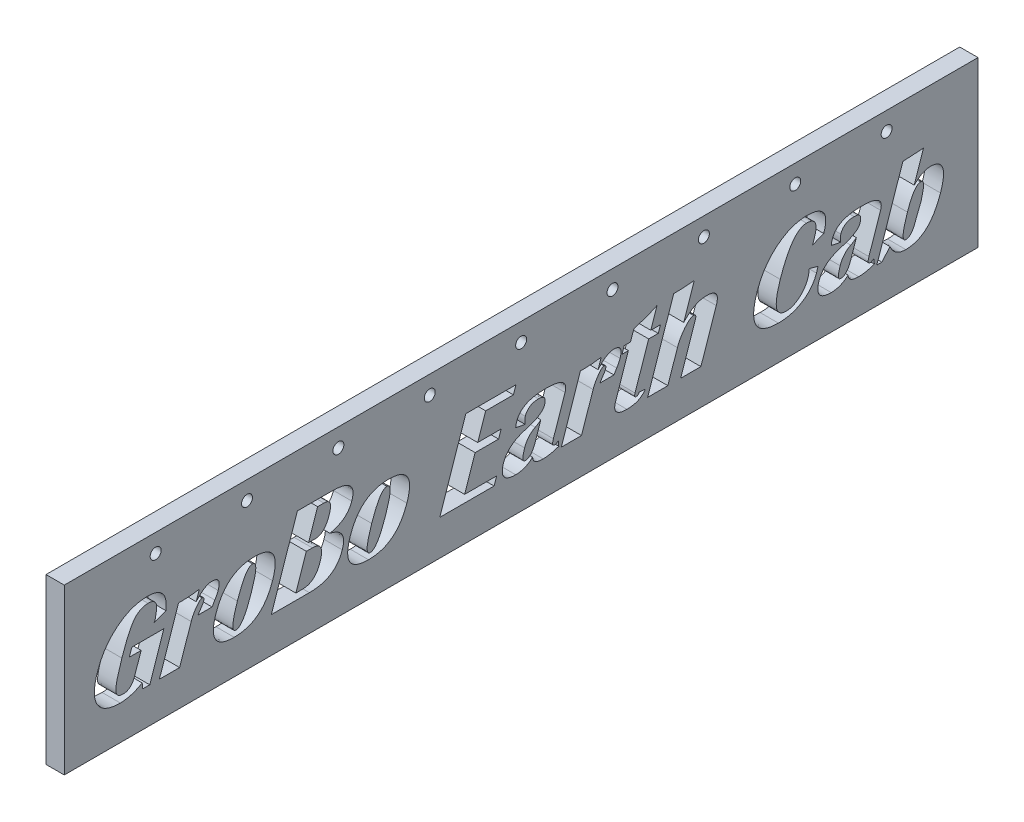
from build123d import *

# Parameters (mm, degrees)
SKETCH1_W           = 10
SKETCH1_H           = 90
BOSS_EXTRUDE1_DEPTH = 500
SKETCH4_R           = 3
CUT_EXTRUDE3_DEPTH  = 10
LPATTERN2_COUNT     = 9
LPATTERN2_PITCH     = 50
CUT_EXTRUDE4_DEPTH  = 10


with BuildPart() as part:
    # Sketch1 → Boss-Extrude1 (new body)
    with BuildSketch(Plane.XY):
        with Locations((20, 50)):
            Rectangle(SKETCH1_W, SKETCH1_H)
    extrude(amount=BOSS_EXTRUDE1_DEPTH)

    # Sketch4 → Cut-Extrude3 (cut)
    with BuildSketch(Plane(origin=(25, 0, 0), x_dir=(0, 0, -1), z_dir=(1, 0, 0))):
        with Locations((-450, 85)):
            Circle(SKETCH4_R)
    cut_extrude3 = extrude(amount=-CUT_EXTRUDE3_DEPTH, mode=Mode.SUBTRACT)

    # LPattern2: Cut-Extrude3 ×9
    with Locations(*[(0, 0, -i * LPATTERN2_PITCH) for i in range(1, LPATTERN2_COUNT)]):
        add(cut_extrude3, mode=Mode.SUBTRACT)

    # Sketch5 → Cut-Extrude4 (cut)
    # profile 1 of 13: a face of its own
    with BuildSketch(Plane(origin=(25, 0, 0), x_dir=(0, 0, -1), z_dir=(1, 0, 0))):
        with BuildLine():
            Line((-462.984573265, 47.11010115), (-445.484573265, 47.11010115))
            Line((-445.484573265, 47.11010115), (-453.213739931, 24.36010115))
            Line((-453.213739931, 24.36010115), (-457.041864931, 24.36010115))
            Line((-457.041864931, 24.36010115), (-457.351760765, 27.2858824))
            add(Edge.make_bspline(
                [(-457.351760765, 27.2858824), (-457.868077996, 27.006027658), (-458.884151645, 26.455294482), (-460.436017799, 25.753802365), (-461.957019508, 25.132017425), (-463.466091578, 24.641260632), (-464.954195305, 24.254513273), (-466.422160781, 23.982102052), (-467.871892603, 23.808609109), (-468.832625787, 23.787338803), (-469.310094098, 23.776767817)],
                knots=[0, 0, 0, 0, 1.118551128, 2.20122486, 3.242793456, 4.247737074, 5.22207397, 6.170056537, 7.09054873, 8, 8, 8, 8], degree=3))
            add(Edge.make_bspline(
                [(-469.310094098, 23.776767817), (-470.058187832, 23.794563724), (-471.495222449, 23.82874839), (-473.560836217, 24.079503397), (-475.434270936, 24.51379454), (-477.127035807, 25.111860233), (-478.628184497, 25.897503928), (-479.936844191, 26.866740714), (-481.070863806, 27.995992378), (-481.984326015, 29.316300075), (-482.697960903, 30.790040401), (-483.212726034, 32.406843485), (-483.493647321, 34.168810486), (-483.584748759, 36.064220095), (-483.444907219, 38.100798257), (-483.095400814, 40.274382052), (-482.563132765, 42.596372224), (-482.052858969, 44.163657931), (-481.787958681, 44.97728865)],
                knots=[0, 0, 0, 0, 1.173851469, 2.25488481, 3.258722454, 4.186243485, 5.064932749, 5.906948539, 6.732937446, 7.564904307, 8.413575601, 9.294164289, 10.217509489, 11.20559843, 12.266156264, 13.414527148, 14.657794092, 16, 16, 16, 16], degree=3))
            add(Edge.make_bspline(
                [(-481.787958681, 44.97728865), (-481.498051043, 45.78066435), (-480.925110675, 47.368364395), (-479.885687695, 49.649445195), (-478.731265165, 51.819639541), (-477.428326348, 53.864187488), (-476.011404848, 55.804415208), (-474.441131378, 57.611522118), (-472.754219381, 59.31117039), (-470.949211623, 60.882292), (-469.053605699, 62.293233205), (-467.112475962, 63.545761456), (-465.113460042, 64.585912682), (-463.079095437, 65.44780995), (-461.001988204, 66.117967202), (-458.884275579, 66.588585788), (-456.728876609, 66.896466425), (-455.274680822, 66.927733829), (-454.544469098, 66.943434484)],
                knots=[0, 0, 0, 0, 1.097867491, 2.169700011, 3.220166006, 4.25630982, 5.284616829, 6.306708197, 7.33160313, 8.361763814, 9.380654501, 10.367957179, 11.329056601, 12.274505217, 13.206073398, 14.131122465, 15.061559455, 16, 16, 16, 16], degree=3))
            add(Edge.make_bspline(
                [(-454.544469098, 66.943434484), (-454.076310435, 66.934928364), (-453.171278158, 66.918484552), (-451.864946427, 66.78611627), (-450.66537658, 66.544820042), (-449.561199436, 66.233989251), (-448.562450469, 65.810891587), (-447.660618664, 65.303460133), (-446.868613908, 64.690454774), (-446.167072752, 64.001308501), (-445.588583398, 63.197838911), (-445.103969483, 62.314491495), (-444.728773582, 61.332570493), (-444.458444245, 60.261628194), (-444.288314479, 59.098189601), (-444.216773758, 57.841840483), (-444.255794272, 56.49464663), (-444.356901537, 55.570928058), (-444.409052431, 55.09447615)],
                knots=[0, 0, 0, 0, 1.216539869, 2.351783563, 3.40626211, 4.393193257, 5.327295304, 6.218467352, 7.074386484, 7.922991183, 8.764699391, 9.637423358, 10.53476469, 11.488415989, 12.502297422, 13.585816583, 14.754769764, 16, 16, 16, 16], degree=3))
            Line((-444.409052431, 55.09447615), (-450.935094098, 52.533278234))
            Line((-450.935094098, 52.533278234), (-450.297073265, 53.526767817))
            Line((-450.297073265, 53.526767817), (-449.923375348, 55.768955317))
            add(Edge.make_bspline(
                [(-449.923375348, 55.768955317), (-449.846964225, 56.078074843), (-449.700177274, 56.671898248), (-449.543981137, 57.542343997), (-449.450492648, 58.352196705), (-449.420595932, 59.104981479), (-449.453657466, 59.798258322), (-449.554069447, 60.433908154), (-449.712019384, 61.014106942), (-449.954071027, 61.526344352), (-450.247610289, 61.986848527), (-450.615914653, 62.376634217), (-451.042276557, 62.715471593), (-451.542979237, 62.976024299), (-452.103321593, 63.18572759), (-452.726742539, 63.34023581), (-453.414591863, 63.431327812), (-453.89400657, 63.439291359), (-454.143427431, 63.443434484)],
                knots=[0, 0, 0, 0, 1.425519488, 2.738445055, 3.956834834, 5.073122937, 6.108470738, 7.059011787, 7.950370333, 8.790310664, 9.586474188, 10.385422321, 11.180073441, 12.013932376, 12.900815628, 13.854369801, 14.883711897, 16, 16, 16, 16], degree=3))
            add(Edge.make_bspline(
                [(-454.143427431, 63.443434484), (-454.517866505, 63.430792635), (-455.256058128, 63.405869737), (-456.340059768, 63.219401407), (-457.376457833, 62.911164644), (-458.358949058, 62.465527641), (-459.296777607, 61.905905274), (-460.185153042, 61.218313987), (-461.014066885, 60.397358732), (-461.815400133, 59.449197825), (-462.584410131, 58.322314583), (-463.366880293, 57.001359258), (-464.173713582, 55.470294309), (-465.001971519, 53.724212037), (-465.847614788, 51.762382763), (-466.706660384, 49.582384832), (-467.603263806, 47.196154933), (-468.180817636, 45.525588433), (-468.480667015, 44.658278234)],
                knots=[0, 0, 0, 0, 0.711556635, 1.402805378, 2.08435864, 2.761689589, 3.448119859, 4.156293033, 4.891460894, 5.662031076, 6.512781243, 7.481510693, 8.579571304, 9.801531164, 11.154492881, 12.639929041, 14.255547556, 16, 16, 16, 16], degree=3))
            add(Edge.make_bspline(
                [(-468.480667015, 44.658278234), (-468.751417721, 43.851213522), (-469.270053868, 42.305241818), (-469.958581529, 40.076504602), (-470.549417288, 38.055403449), (-471.014039184, 36.233024365), (-471.384925938, 34.618468137), (-471.640406776, 33.201576244), (-471.768347641, 31.985900647), (-471.812781733, 30.957547966), (-471.726997353, 30.079909435), (-471.515899931, 29.331414478), (-471.204567353, 28.679121449), (-470.734480574, 28.171671289), (-470.176347557, 27.750495021), (-469.483911874, 27.478591229), (-468.68730877, 27.299607073), (-468.11724313, 27.284676132), (-467.815302431, 27.276767817)],
                knots=[0, 0, 0, 0, 2.011714535, 3.853537027, 5.51243933, 6.987459781, 8.297393381, 9.427070204, 10.387301812, 11.184585839, 11.85618591, 12.460767117, 13.01628735, 13.545184736, 14.079416327, 14.655483702, 15.287864131, 16, 16, 16, 16], degree=3))
            add(Edge.make_bspline(
                [(-467.815302431, 27.276767817), (-467.45245228, 27.291913931), (-466.745221893, 27.321435188), (-465.725229291, 27.56972686), (-464.8004716, 28.003845905), (-463.945243002, 28.577135781), (-463.203990536, 29.350547723), (-462.534515319, 30.267622329), (-461.95874951, 31.356805143), (-461.662683726, 32.155224407), (-461.508010765, 32.572340734)],
                knots=[0, 0, 0, 0, 0.980863606, 1.911798979, 2.816495171, 3.732950069, 4.680285781, 5.697892679, 6.797315407, 8, 8, 8, 8], degree=3))
            Line((-461.508010765, 32.572340734), (-457.953323265, 43.026767817))
            Line((-457.953323265, 43.026767817), (-464.369989931, 43.026767817))
            Line((-464.369989931, 43.026767817), (-462.984573265, 47.11010115))
        make_face()
    # profile 2 of 13: a face of its own
    with BuildSketch(Plane(origin=(25, 0, 0), x_dir=(0, 0, -1), z_dir=(1, 0, 0))):
        with BuildLine():
            Line((-419.125198265, 44.193434484), (-426.808792015, 44.193434484))
            add(Edge.make_bspline(
                [(-426.808792015, 44.193434484), (-426.636759799, 44.479735355), (-426.314938006, 45.015320275), (-425.850975578, 45.749291678), (-425.44996673, 46.370503432), (-425.187718392, 46.734272694), (-425.067906598, 46.900465734)],
                knots=[0, 0, 0, 0, 1.244874051, 2.328794053, 3.236486356, 4, 4, 4, 4], degree=3))
            add(Edge.make_bspline(
                [(-425.067906598, 46.900465734), (-424.919466721, 47.105273134), (-424.634915411, 47.497877977), (-424.267961033, 48.089350338), (-423.981706598, 48.654302485), (-423.84051859, 49.028969886), (-423.773635765, 49.206455317)],
                knots=[0, 0, 0, 0, 1.143064377, 2.191193324, 3.143141809, 4, 4, 4, 4], degree=3))
            add(Edge.make_bspline(
                [(-423.773635765, 49.206455317), (-423.725078566, 49.360466265), (-423.635672264, 49.644040069), (-423.553691899, 50.050933433), (-423.552634542, 50.399869763), (-423.605414936, 50.695597289), (-423.75498029, 50.922060181), (-423.967299507, 51.081508566), (-424.244642402, 51.187709502), (-424.453058927, 51.191415468), (-424.566604515, 51.193434484)],
                knots=[0, 0, 0, 0, 1.461138339, 2.69033184, 3.734784726, 4.60829083, 5.363019644, 6.127198478, 6.979695349, 8, 8, 8, 8], degree=3))
            add(Edge.make_bspline(
                [(-424.566604515, 51.193434484), (-424.665090547, 51.186639954), (-424.8786977, 51.171903245), (-425.197367543, 51.024826849), (-425.550653988, 50.825516439), (-425.916468415, 50.527521983), (-426.315415495, 50.159199097), (-426.726214069, 49.699984828), (-427.17966423, 49.172553216), (-427.786387492, 48.345885703), (-428.536049449, 47.258941444), (-429.319948411, 45.881820707), (-430.001501719, 44.474256587), (-430.359107523, 43.500912545), (-430.536656598, 43.017653234)],
                knots=[0, 0, 0, 0, 0.338308942, 0.733761006, 1.194388994, 1.739996634, 2.356085563, 3.068823225, 3.865342818, 4.75703659, 6.60756462, 8.421422893, 10.223258548, 12, 12, 12, 12], degree=3))
            Line((-430.536656598, 43.017653234), (-436.880406598, 24.36010115))
            Line((-436.880406598, 24.36010115), (-447.963739931, 24.36010115))
            Line((-447.963739931, 24.36010115), (-437.454625348, 55.276767817))
            Line((-437.454625348, 55.276767817), (-435.294469098, 55.276767817))
            add(Edge.make_bspline(
                [(-435.294469098, 55.276767817), (-434.625869614, 55.289818971), (-433.220478963, 55.317252389), (-431.015687852, 55.468245826), (-428.617615285, 55.72612739), (-426.960009467, 55.964160044), (-426.097854515, 56.087965734)],
                knots=[0, 0, 0, 0, 0.868376822, 1.825320985, 2.868904619, 4, 4, 4, 4], degree=3))
            Line((-426.097854515, 56.087965734), (-427.811396181, 51.038486567))
            add(Edge.make_bspline(
                [(-427.811396181, 51.038486567), (-427.437281974, 51.466026677), (-426.71926962, 52.286575789), (-425.592742849, 53.387391709), (-424.481930357, 54.317809134), (-423.397433025, 55.09453827), (-422.326337689, 55.697432227), (-421.269032209, 56.119747277), (-420.229981792, 56.39578408), (-419.536945804, 56.42778767), (-419.198114931, 56.443434484)],
                knots=[0, 0, 0, 0, 1.301636123, 2.498143075, 3.605399216, 4.61962079, 5.551559049, 6.413976809, 7.224580497, 8, 8, 8, 8], degree=3))
            add(Edge.make_bspline(
                [(-419.198114931, 56.443434484), (-418.979225118, 56.437007357), (-418.561756153, 56.424749474), (-417.962972247, 56.364885414), (-417.422500446, 56.250915023), (-416.946078556, 56.07179939), (-416.516401757, 55.866573797), (-416.153325328, 55.60006482), (-415.841072852, 55.293015971), (-415.594700358, 54.934290552), (-415.406929946, 54.524469953), (-415.299417303, 54.065940789), (-415.215126698, 53.566315565), (-415.230446966, 53.018284895), (-415.269457279, 52.423361741), (-415.384110118, 51.783281789), (-415.560832786, 51.09691114), (-415.710835756, 50.62760213), (-415.789260765, 50.382236567)],
                knots=[0, 0, 0, 0, 1.199676795, 2.288036254, 3.293812858, 4.215472003, 5.071657635, 5.894163468, 6.671097303, 7.460768606, 8.26538989, 9.125451146, 10.034240496, 11.033104465, 12.118403863, 13.300744553, 14.588767064, 16, 16, 16, 16], degree=3))
            add(Edge.make_bspline(
                [(-415.789260765, 50.382236567), (-415.892594806, 50.104580788), (-416.108816581, 49.523598712), (-416.511401671, 48.633152688), (-417.030630295, 47.699091539), (-417.412852524, 47.060373465), (-417.612177431, 46.72728865)],
                knots=[0, 0, 0, 0, 0.868546727, 1.81739448, 2.86179398, 4, 4, 4, 4], degree=3))
            add(Edge.make_bspline(
                [(-417.612177431, 46.72728865), (-417.706475537, 46.569370506), (-417.916710322, 46.217296762), (-418.26037919, 45.635399963), (-418.673581245, 44.950587344), (-418.967452535, 44.457901111), (-419.125198265, 44.193434484)],
                knots=[0, 0, 0, 0, 0.747881635, 1.667379578, 2.74788412, 4, 4, 4, 4], degree=3))
        make_face()
    # profile 3 of 13: a face of its own
    with BuildSketch(Plane(origin=(25, 0, 0), x_dir=(0, 0, -1), z_dir=(1, 0, 0))):
        with BuildLine():
            add(Edge.make_bspline(
                [(-395.919469098, 56.443434484), (-395.302192894, 56.432239576), (-394.119097965, 56.410782994), (-392.428715158, 56.22060059), (-390.900946675, 55.905400602), (-389.533295348, 55.463728044), (-388.325304685, 54.889082962), (-387.278925281, 54.186336594), (-386.407596666, 53.340195579), (-385.694765848, 52.371836185), (-385.153191406, 51.269606174), (-384.780309215, 50.041521549), (-384.576514716, 48.688589791), (-384.534082219, 47.210861199), (-384.675335051, 45.6098089), (-384.961313679, 43.882340913), (-385.410770667, 42.02750511), (-385.817996346, 40.766854485), (-386.030146181, 40.11010115)],
                knots=[0, 0, 0, 0, 1.229247068, 2.356021443, 3.382708377, 4.331935857, 5.211636368, 6.039164321, 6.8309341, 7.618924968, 8.422745332, 9.265012565, 10.165451544, 11.140262277, 12.202712173, 13.361787333, 14.625586715, 16, 16, 16, 16], degree=3))
            add(Edge.make_bspline(
                [(-386.030146181, 40.11010115), (-386.265034087, 39.447681132), (-386.725035628, 38.150406047), (-387.53940627, 36.296327208), (-388.435719485, 34.574637698), (-389.387157738, 32.964860625), (-390.441941544, 31.502277779), (-391.552157475, 30.14596847), (-392.760303074, 28.938709628), (-394.030931515, 27.842227994), (-395.386298992, 26.881626218), (-396.821404068, 26.051386298), (-398.333469168, 25.344790774), (-399.923657028, 24.771914027), (-401.588441493, 24.324527814), (-403.328924322, 24.007373414), (-405.148044377, 23.81156286), (-406.388585885, 23.78851695), (-407.021031598, 23.776767817)],
                knots=[0, 0, 0, 0, 1.175065552, 2.301233694, 3.382913599, 4.419814754, 5.425063526, 6.395650903, 7.347709817, 8.277394233, 9.199369194, 10.121358154, 11.046477625, 11.986695364, 12.944323502, 13.925912684, 14.942600774, 16, 16, 16, 16], degree=3))
            add(Edge.make_bspline(
                [(-407.021031598, 23.776767817), (-407.638342891, 23.787798207), (-408.821505073, 23.808939469), (-410.517347336, 24.001945838), (-412.052366087, 24.311894806), (-413.425232216, 24.756876782), (-414.633948668, 25.330526758), (-415.679867566, 26.036941763), (-416.560444209, 26.876670001), (-417.272660109, 27.848791682), (-417.814810902, 28.950478304), (-418.187330985, 30.178703134), (-418.392047321, 31.531656469), (-418.430765947, 33.008879612), (-418.305267964, 34.6109073), (-418.014527545, 36.337775417), (-417.566507444, 38.192721731), (-417.159071976, 39.453356221), (-416.946812848, 40.11010115)],
                knots=[0, 0, 0, 0, 1.228038986, 2.353705987, 3.391218502, 4.339513098, 5.218349054, 6.045063728, 6.840410309, 7.627626754, 8.430657137, 9.272096605, 10.171650648, 11.145503354, 12.206444081, 13.364380122, 14.626937465, 16, 16, 16, 16], degree=3))
            add(Edge.make_bspline(
                [(-416.946812848, 40.11010115), (-416.71201153, 40.772576591), (-416.252179563, 42.069960216), (-415.436593636, 43.923261186), (-414.543901686, 45.64912424), (-413.577134035, 47.248872119), (-412.538097056, 48.725007967), (-411.413762224, 50.067074924), (-410.216878755, 51.287963006), (-408.93593883, 52.377521101), (-407.573977543, 53.336296984), (-406.137498797, 54.169132923), (-404.625171475, 54.875177301), (-403.032494597, 55.449915906), (-401.361011481, 55.895483606), (-399.614497322, 56.21208778), (-397.792470619, 56.408750962), (-396.551919639, 56.431723008), (-395.919469098, 56.443434484)],
                knots=[0, 0, 0, 0, 1.17379807, 2.298751473, 3.379264627, 4.417667667, 5.418890693, 6.391680266, 7.339143885, 8.271686748, 9.196811248, 10.117805706, 11.0419273, 11.981130875, 12.942627758, 13.928149894, 14.943741336, 16, 16, 16, 16], degree=3))
        make_face()
        with BuildLine():
            add(Edge.make_bspline(
                [(-396.940302431, 53.526767817), (-397.099348604, 53.514818914), (-397.427512314, 53.490164461), (-397.918130516, 53.326639834), (-398.404344451, 53.051697073), (-398.901507138, 52.682250415), (-399.398440337, 52.201484732), (-399.912538872, 51.626484047), (-400.416536965, 50.936077404), (-400.940365263, 50.152362613), (-401.453202645, 49.254937568), (-401.984869242, 48.259313037), (-402.51760671, 47.156342959), (-403.06852406, 45.952772927), (-403.609413624, 44.63894959), (-404.167162325, 43.223632644), (-404.732347437, 41.705261967), (-405.094141695, 40.651736323), (-405.280146181, 40.11010115)],
                knots=[0, 0, 0, 0, 0.465798473, 0.96109295, 1.498705268, 2.096703288, 2.770241422, 3.520316646, 4.353229604, 5.271341494, 6.280187857, 7.378906499, 8.576821054, 9.867090618, 11.255275713, 12.73753087, 14.322709995, 16, 16, 16, 16], degree=3))
            add(Edge.make_bspline(
                [(-405.280146181, 40.11010115), (-405.46120495, 39.569903083), (-405.811142576, 38.525846331), (-406.287425277, 37.007917744), (-406.685451254, 35.589187665), (-407.037440892, 34.282394888), (-407.312960734, 33.074989991), (-407.518076307, 31.973386828), (-407.687846266, 30.978869194), (-407.754245809, 30.085087256), (-407.778977014, 29.297086943), (-407.743563118, 28.610483099), (-407.621526953, 28.030077656), (-407.460246319, 27.542252924), (-407.206323053, 27.163387607), (-406.888361774, 26.88452697), (-406.493740195, 26.722886505), (-406.211295601, 26.703529295), (-406.064000348, 26.693434484)],
                knots=[0, 0, 0, 0, 1.867939927, 3.610222641, 5.215197755, 6.698700538, 8.047097408, 9.273972599, 10.372859214, 11.352294881, 12.209181684, 12.957923034, 13.598694019, 14.150165215, 14.630885378, 15.076025384, 15.51814594, 16, 16, 16, 16], degree=3))
            add(Edge.make_bspline(
                [(-406.064000348, 26.693434484), (-405.901820258, 26.705012767), (-405.570402472, 26.728673189), (-405.075236249, 26.895815636), (-404.583101076, 27.165445363), (-404.084788806, 27.538398808), (-403.58766926, 28.018646694), (-403.073057952, 28.593432475), (-402.570722881, 29.286925165), (-402.034374855, 30.06439571), (-401.526027464, 30.968228643), (-400.981121886, 31.958181703), (-400.449151796, 33.062089284), (-399.910698328, 34.269792119), (-399.366733104, 35.580894406), (-398.81003613, 36.996675266), (-398.244545894, 38.514911354), (-397.882795026, 39.568456137), (-397.696812848, 40.11010115)],
                knots=[0, 0, 0, 0, 0.47398303, 0.968592427, 1.513273463, 2.110444346, 2.783050859, 3.532088596, 4.363849489, 5.285630575, 6.293081526, 7.394482706, 8.590740334, 9.875573513, 11.261838504, 12.74204344, 14.325029983, 16, 16, 16, 16], degree=3))
            add(Edge.make_bspline(
                [(-397.696812848, 40.11010115), (-397.515348403, 40.65018347), (-397.164626714, 41.694016514), (-396.693530412, 43.214296552), (-396.277160501, 44.627868704), (-395.940867353, 45.939135709), (-395.669314375, 47.14664459), (-395.438887973, 48.243655049), (-395.307643422, 49.243816736), (-395.220283414, 50.134195874), (-395.193451297, 50.924053065), (-395.249707108, 51.607684079), (-395.349981044, 52.193032146), (-395.526549571, 52.679342563), (-395.788941163, 53.054438026), (-396.106471722, 53.335980898), (-396.504407364, 53.498418791), (-396.789946841, 53.516989237), (-396.940302431, 53.526767817)],
                knots=[0, 0, 0, 0, 1.865850032, 3.606183439, 5.212108544, 6.691444057, 8.03833231, 9.265731815, 10.360498967, 11.339698587, 12.195626685, 12.944258019, 13.5823757, 14.136723438, 14.622542498, 15.06718447, 15.508810371, 16, 16, 16, 16], degree=3))
        make_face(mode=Mode.SUBTRACT)
    # profile 4 of 13: a face of its own
    with BuildSketch(Plane(origin=(25, 0, 0), x_dir=(0, 0, -1), z_dir=(1, 0, 0))):
        with BuildLine():
            Line((-386.713739931, 24.36010115), (-372.440302431, 66.36010115))
            Line((-372.440302431, 66.36010115), (-353.700719098, 66.36010115))
            add(Edge.make_bspline(
                [(-353.700719098, 66.36010115), (-353.120201297, 66.354403913), (-352.003416432, 66.343443719), (-350.396420681, 66.224273533), (-348.927801831, 66.029994174), (-347.602086215, 65.74908577), (-346.413849661, 65.3950372), (-345.362287003, 64.966912778), (-344.453380165, 64.439368488), (-343.681043044, 63.84006781), (-343.045626675, 63.157434599), (-342.564697308, 62.385623188), (-342.22345511, 61.533811121), (-342.0271686, 60.603463494), (-341.959865208, 59.59570378), (-342.069433642, 58.514032388), (-342.281940652, 57.34794108), (-342.532102651, 56.562579046), (-342.662958681, 56.151767817)],
                knots=[0, 0, 0, 0, 1.485621751, 2.858000022, 4.121638237, 5.274700549, 6.322701076, 7.291762734, 8.17338372, 9.004114968, 9.785635429, 10.547287957, 11.318409231, 12.122244262, 12.971620071, 13.892526738, 14.897612001, 16, 16, 16, 16], degree=3))
            add(Edge.make_bspline(
                [(-342.662958681, 56.151767817), (-342.77100064, 55.855277294), (-342.985671919, 55.266172832), (-343.381591465, 54.422220449), (-343.817969278, 53.610425966), (-344.323215259, 52.845995981), (-344.877394155, 52.115534515), (-345.489760274, 51.429393247), (-346.159788504, 50.793261742), (-346.873522184, 50.184657945), (-347.647899644, 49.621920573), (-348.479290465, 49.10112798), (-349.367864949, 48.628255648), (-350.308375858, 48.191195621), (-351.301580349, 47.787843026), (-352.353727439, 47.436792405), (-353.455704692, 47.112550364), (-354.216127944, 46.941785212), (-354.603062848, 46.854892817)],
                knots=[0, 0, 0, 0, 0.952929994, 1.893400523, 2.81349351, 3.735096158, 4.658525393, 5.581635235, 6.509978298, 7.447847244, 8.413555848, 9.39916916, 10.409393355, 11.452444208, 12.531387913, 13.646013535, 14.802194012, 16, 16, 16, 16], degree=3))
            add(Edge.make_bspline(
                [(-354.603062848, 46.854892817), (-354.209638364, 46.763286945), (-353.449258517, 46.586238334), (-352.370753367, 46.238165341), (-351.390565828, 45.839552586), (-350.510646313, 45.38361395), (-349.729937526, 44.876163091), (-349.056291416, 44.303177031), (-348.480849155, 43.682647959), (-347.990037384, 43.010578066), (-347.635127637, 42.264115058), (-347.351495359, 41.475596215), (-347.191889812, 40.626971642), (-347.13302276, 39.728296143), (-347.157120589, 38.774781424), (-347.302843251, 37.769056562), (-347.538676584, 36.707846075), (-347.767305689, 35.994739229), (-347.885614931, 35.62572615)],
                knots=[0, 0, 0, 0, 1.254203461, 2.424025637, 3.515768501, 4.537180265, 5.497712647, 6.401501271, 7.276250524, 8.122016202, 8.97449358, 9.833992916, 10.718611784, 11.645745398, 12.627550143, 13.67517221, 14.796965889, 16, 16, 16, 16], degree=3))
            add(Edge.make_bspline(
                [(-347.885614931, 35.62572615), (-348.051198331, 35.166894392), (-348.376496017, 34.265494195), (-348.985794607, 32.989338202), (-349.65880129, 31.791854588), (-350.427064226, 30.691606422), (-351.266989069, 29.671999541), (-352.19484131, 28.74399183), (-353.206237911, 27.911411384), (-354.289043886, 27.151800017), (-355.462929426, 26.499704126), (-356.711153803, 25.923803392), (-358.044419062, 25.440251031), (-359.454545497, 25.040729334), (-360.947101416, 24.731079472), (-362.51833373, 24.514613258), (-364.171257269, 24.387256195), (-365.300319973, 24.36929022), (-365.877802431, 24.36010115)],
                knots=[0, 0, 0, 0, 1.022095522, 2.007962804, 2.960764516, 3.898998471, 4.817302134, 5.727105781, 6.645409443, 7.560681698, 8.49612235, 9.456600375, 10.439954105, 11.466248627, 12.526837531, 13.633020507, 14.789359413, 16, 16, 16, 16], degree=3))
            Line((-365.877802431, 24.36010115), (-386.713739931, 24.36010115))
        make_face()
        with BuildLine():
            Line((-373.269729515, 27.86010115), (-369.797073265, 27.86010115))
            add(Edge.make_bspline(
                [(-369.797073265, 27.86010115), (-369.507996649, 27.862942336), (-368.94315751, 27.868493849), (-368.116857208, 27.982767649), (-367.317673043, 28.117158854), (-366.557599735, 28.341012437), (-365.825196639, 28.612876296), (-365.135657159, 28.961973193), (-364.476846002, 29.367542984), (-363.840464295, 29.817434231), (-363.261742186, 30.357084177), (-362.69956701, 30.937827438), (-362.181782123, 31.592309359), (-361.688734403, 32.298139362), (-361.242259874, 33.073197071), (-360.824333123, 33.904577972), (-360.426746202, 34.795052827), (-360.209888863, 35.423378449), (-360.099156598, 35.744215734)],
                knots=[0, 0, 0, 0, 1.028092588, 2.008833989, 2.965663052, 3.910618571, 4.824672251, 5.743768055, 6.656476737, 7.578178469, 8.512425225, 9.468765049, 10.4536136, 11.47976972, 12.531656215, 13.634581789, 14.792163923, 16, 16, 16, 16], degree=3))
            add(Edge.make_bspline(
                [(-360.099156598, 35.744215734), (-359.979674754, 36.107569796), (-359.750373606, 36.804893345), (-359.483849972, 37.830359366), (-359.299449471, 38.786130838), (-359.19385163, 39.673017308), (-359.177067617, 40.487316643), (-359.220234674, 41.232629129), (-359.372418495, 41.905003591), (-359.585016036, 42.514487243), (-359.89287965, 43.052762159), (-360.27518544, 43.521715488), (-360.746737091, 43.914362127), (-361.296258197, 44.231709394), (-361.927410484, 44.476269195), (-362.632823061, 44.661407308), (-363.423496893, 44.754802661), (-363.975691068, 44.769224398), (-364.264521181, 44.776767817)],
                knots=[0, 0, 0, 0, 1.477223888, 2.834984147, 4.089401374, 5.235073522, 6.279826315, 7.233033148, 8.110085452, 8.934271843, 9.717413368, 10.492778076, 11.259119855, 12.074316839, 12.932959627, 13.866603934, 14.884108063, 16, 16, 16, 16], degree=3))
            Line((-364.264521181, 44.776767817), (-367.527542015, 44.776767817))
            Line((-367.527542015, 44.776767817), (-373.269729515, 27.86010115))
        make_face(mode=Mode.SUBTRACT)
        with BuildLine():
            Line((-366.333531598, 48.276767817), (-362.578323265, 48.276767817))
            add(Edge.make_bspline(
                [(-362.578323265, 48.276767817), (-362.171372432, 48.298337117), (-361.368571887, 48.340887333), (-360.208718704, 48.720601488), (-359.127320977, 49.321387647), (-358.131345677, 50.172016378), (-357.227879043, 51.262501172), (-356.389545847, 52.575279967), (-355.634111767, 54.128800468), (-355.221259343, 55.263345633), (-355.004104515, 55.86010115)],
                knots=[0, 0, 0, 0, 0.849006126, 1.674852407, 2.525188669, 3.422434471, 4.39615858, 5.476450165, 6.672646685, 8, 8, 8, 8], degree=3))
            add(Edge.make_bspline(
                [(-355.004104515, 55.86010115), (-354.913669278, 56.141930297), (-354.739694236, 56.684099914), (-354.526298453, 57.476695408), (-354.381484543, 58.217251893), (-354.285041104, 58.901529988), (-354.254256271, 59.533625324), (-354.291665502, 60.110681119), (-354.376903066, 60.636415414), (-354.534479234, 61.105204912), (-354.743271177, 61.524473297), (-355.021751249, 61.886499976), (-355.364108945, 62.188898645), (-355.761766571, 62.437032518), (-356.21927603, 62.632256029), (-356.738971208, 62.762949122), (-357.316531706, 62.846304442), (-357.719936734, 62.855378583), (-357.929885765, 62.86010115)],
                knots=[0, 0, 0, 0, 1.506678831, 2.898477659, 4.175458047, 5.34569909, 6.413884814, 7.390226299, 8.285271883, 9.11672258, 9.898346833, 10.65934739, 11.426141061, 12.211429198, 13.035946203, 13.947542363, 14.931814275, 16, 16, 16, 16], degree=3))
            Line((-357.929885765, 62.86010115), (-361.375198265, 62.86010115))
            Line((-361.375198265, 62.86010115), (-366.333531598, 48.276767817))
        make_face(mode=Mode.SUBTRACT)
    # profile 5 of 13: a face of its own
    with BuildSketch(Plane(origin=(25, 0, 0), x_dir=(0, 0, -1), z_dir=(1, 0, 0))):
        with BuildLine():
            add(Edge.make_bspline(
                [(-322.419469098, 56.443434484), (-321.802192894, 56.432239576), (-320.619097965, 56.410782994), (-318.928715158, 56.22060059), (-317.400946675, 55.905400602), (-316.033295348, 55.463728044), (-314.825304685, 54.889082962), (-313.778925281, 54.186336594), (-312.907596666, 53.340195579), (-312.194765848, 52.371836185), (-311.653191406, 51.269606174), (-311.280309215, 50.041521549), (-311.076514716, 48.688589791), (-311.034082219, 47.210861199), (-311.175335051, 45.6098089), (-311.461313679, 43.882340913), (-311.910770667, 42.02750511), (-312.317996346, 40.766854485), (-312.530146181, 40.11010115)],
                knots=[0, 0, 0, 0, 1.229247068, 2.356021443, 3.382708377, 4.331935857, 5.211636368, 6.039164321, 6.8309341, 7.618924968, 8.422745332, 9.265012565, 10.165451544, 11.140262277, 12.202712173, 13.361787333, 14.625586715, 16, 16, 16, 16], degree=3))
            add(Edge.make_bspline(
                [(-312.530146181, 40.11010115), (-312.765034087, 39.447681132), (-313.225035628, 38.150406047), (-314.03940627, 36.296327208), (-314.935719485, 34.574637698), (-315.887157738, 32.964860625), (-316.941941544, 31.502277779), (-318.052157475, 30.14596847), (-319.260303074, 28.938709628), (-320.530931515, 27.842227994), (-321.886298992, 26.881626218), (-323.321404068, 26.051386298), (-324.833469168, 25.344790774), (-326.423657028, 24.771914027), (-328.088441493, 24.324527814), (-329.828924322, 24.007373414), (-331.648044377, 23.81156286), (-332.888585885, 23.78851695), (-333.521031598, 23.776767817)],
                knots=[0, 0, 0, 0, 1.175065552, 2.301233694, 3.382913599, 4.419814754, 5.425063526, 6.395650903, 7.347709817, 8.277394233, 9.199369194, 10.121358154, 11.046477625, 11.986695364, 12.944323502, 13.925912684, 14.942600774, 16, 16, 16, 16], degree=3))
            add(Edge.make_bspline(
                [(-333.521031598, 23.776767817), (-334.138342891, 23.787798207), (-335.321505073, 23.808939469), (-337.017347336, 24.001945838), (-338.552366087, 24.311894806), (-339.925232216, 24.756876782), (-341.133948668, 25.330526758), (-342.179867566, 26.036941763), (-343.060444209, 26.876670001), (-343.772660109, 27.848791682), (-344.314810902, 28.950478304), (-344.687330985, 30.178703134), (-344.892047321, 31.531656469), (-344.930765947, 33.008879612), (-344.805267964, 34.6109073), (-344.514527545, 36.337775417), (-344.066507444, 38.192721731), (-343.659071976, 39.453356221), (-343.446812848, 40.11010115)],
                knots=[0, 0, 0, 0, 1.228038986, 2.353705987, 3.391218502, 4.339513098, 5.218349054, 6.045063728, 6.840410309, 7.627626754, 8.430657137, 9.272096605, 10.171650648, 11.145503354, 12.206444081, 13.364380122, 14.626937465, 16, 16, 16, 16], degree=3))
            add(Edge.make_bspline(
                [(-343.446812848, 40.11010115), (-343.21201153, 40.772576591), (-342.752179563, 42.069960216), (-341.936593636, 43.923261186), (-341.043901686, 45.64912424), (-340.077134035, 47.248872119), (-339.038097056, 48.725007967), (-337.913762224, 50.067074924), (-336.716878755, 51.287963006), (-335.43593883, 52.377521101), (-334.073977543, 53.336296984), (-332.637498797, 54.169132923), (-331.125171475, 54.875177301), (-329.532494597, 55.449915906), (-327.861011481, 55.895483606), (-326.114497322, 56.21208778), (-324.292470619, 56.408750962), (-323.051919639, 56.431723008), (-322.419469098, 56.443434484)],
                knots=[0, 0, 0, 0, 1.17379807, 2.298751473, 3.379264627, 4.417667667, 5.418890693, 6.391680266, 7.339143885, 8.271686748, 9.196811248, 10.117805706, 11.0419273, 11.981130875, 12.942627758, 13.928149894, 14.943741336, 16, 16, 16, 16], degree=3))
        make_face()
        with BuildLine():
            add(Edge.make_bspline(
                [(-323.440302431, 53.526767817), (-323.599348604, 53.514818914), (-323.927512314, 53.490164461), (-324.418130516, 53.326639834), (-324.904344451, 53.051697073), (-325.401507138, 52.682250415), (-325.898440337, 52.201484732), (-326.412538872, 51.626484047), (-326.916536965, 50.936077404), (-327.440365263, 50.152362613), (-327.953202645, 49.254937568), (-328.484869242, 48.259313037), (-329.01760671, 47.156342959), (-329.56852406, 45.952772927), (-330.109413624, 44.63894959), (-330.667162325, 43.223632644), (-331.232347437, 41.705261967), (-331.594141695, 40.651736323), (-331.780146181, 40.11010115)],
                knots=[0, 0, 0, 0, 0.465798473, 0.96109295, 1.498705268, 2.096703288, 2.770241422, 3.520316646, 4.353229604, 5.271341494, 6.280187857, 7.378906499, 8.576821054, 9.867090618, 11.255275713, 12.73753087, 14.322709995, 16, 16, 16, 16], degree=3))
            add(Edge.make_bspline(
                [(-331.780146181, 40.11010115), (-331.96120495, 39.569903083), (-332.311142576, 38.525846331), (-332.787425277, 37.007917744), (-333.185451254, 35.589187665), (-333.537440892, 34.282394888), (-333.812960734, 33.074989991), (-334.018076307, 31.973386828), (-334.187846266, 30.978869194), (-334.254245809, 30.085087256), (-334.278977014, 29.297086943), (-334.243563118, 28.610483099), (-334.121526953, 28.030077656), (-333.960246319, 27.542252924), (-333.706323053, 27.163387607), (-333.388361774, 26.88452697), (-332.993740195, 26.722886505), (-332.711295601, 26.703529295), (-332.564000348, 26.693434484)],
                knots=[0, 0, 0, 0, 1.867939927, 3.610222641, 5.215197755, 6.698700538, 8.047097408, 9.273972599, 10.372859214, 11.352294881, 12.209181684, 12.957923034, 13.598694019, 14.150165215, 14.630885378, 15.076025384, 15.51814594, 16, 16, 16, 16], degree=3))
            add(Edge.make_bspline(
                [(-332.564000348, 26.693434484), (-332.401820258, 26.705012767), (-332.070402472, 26.728673189), (-331.575236249, 26.895815636), (-331.083101076, 27.165445363), (-330.584788806, 27.538398808), (-330.08766926, 28.018646694), (-329.573057952, 28.593432475), (-329.070722881, 29.286925165), (-328.534374855, 30.06439571), (-328.026027464, 30.968228643), (-327.481121886, 31.958181703), (-326.949151796, 33.062089284), (-326.410698328, 34.269792119), (-325.866733104, 35.580894406), (-325.31003613, 36.996675266), (-324.744545894, 38.514911354), (-324.382795026, 39.568456137), (-324.196812848, 40.11010115)],
                knots=[0, 0, 0, 0, 0.47398303, 0.968592427, 1.513273463, 2.110444346, 2.783050859, 3.532088596, 4.363849489, 5.285630575, 6.293081526, 7.394482706, 8.590740334, 9.875573513, 11.261838504, 12.74204344, 14.325029983, 16, 16, 16, 16], degree=3))
            add(Edge.make_bspline(
                [(-324.196812848, 40.11010115), (-324.015348403, 40.65018347), (-323.664626714, 41.694016514), (-323.193530412, 43.214296552), (-322.777160501, 44.627868704), (-322.440867353, 45.939135709), (-322.169314375, 47.14664459), (-321.938887973, 48.243655049), (-321.807643422, 49.243816736), (-321.720283414, 50.134195874), (-321.693451297, 50.924053065), (-321.749707108, 51.607684079), (-321.849981044, 52.193032146), (-322.026549571, 52.679342563), (-322.288941163, 53.054438026), (-322.606471722, 53.335980898), (-323.004407364, 53.498418791), (-323.289946841, 53.516989237), (-323.440302431, 53.526767817)],
                knots=[0, 0, 0, 0, 1.865850032, 3.606183439, 5.212108544, 6.691444057, 8.03833231, 9.265731815, 10.360498967, 11.339698587, 12.195626685, 12.944258019, 13.5823757, 14.136723438, 14.622542498, 15.06718447, 15.508810371, 16, 16, 16, 16], degree=3))
        make_face(mode=Mode.SUBTRACT)
    # profile 6 of 13: a face of its own
    with BuildSketch(Plane(origin=(25, 0, 0), x_dir=(0, 0, -1), z_dir=(1, 0, 0))):
        Polygon((-252.856969098, 66.36010115), (-254.242385765, 62.276767817), (-269.409052431, 62.276767817), (-273.774937848, 49.443434484), (-260.941604515, 49.443434484), (-262.327021181, 45.36010115), (-275.160354515, 45.36010115), (-280.911656598, 28.443434484), (-263.411656598, 28.443434484), (-264.797073265, 24.36010115), (-294.547073265, 24.36010115), (-280.273635765, 66.36010115), align=None)
    # profile 7 of 13: a face of its own
    with BuildSketch(Plane(origin=(25, 0, 0), x_dir=(0, 0, -1), z_dir=(1, 0, 0))):
        with BuildLine():
            add(Edge.make_bspline(
                [(-229.414260765, 25.472080317), (-230.170144662, 25.213636228), (-231.633424404, 24.713326588), (-233.822994758, 24.187269835), (-235.914443389, 23.84682219), (-237.281991092, 23.799653545), (-237.945510765, 23.776767817)],
                knots=[0, 0, 0, 0, 1.096438446, 2.122543122, 3.089077793, 4, 4, 4, 4], degree=3))
            add(Edge.make_bspline(
                [(-237.945510765, 23.776767817), (-238.395775628, 23.785015028), (-239.239402419, 23.800467194), (-240.419270052, 23.970399227), (-241.422981495, 24.255052789), (-242.260231253, 24.653886159), (-242.918545514, 25.183477521), (-243.404411535, 25.832035182), (-243.695525836, 26.610301548), (-243.738289782, 27.167940863), (-243.760614931, 27.459059484)],
                knots=[0, 0, 0, 0, 1.394250094, 2.612299619, 3.681604072, 4.616137303, 5.465854739, 6.273499309, 7.098670974, 8, 8, 8, 8], degree=3))
            add(Edge.make_bspline(
                [(-243.760614931, 27.459059484), (-244.095357997, 27.163543727), (-244.755750251, 26.580540412), (-245.82714613, 25.837842417), (-246.92764241, 25.203301273), (-248.062880664, 24.676277354), (-249.24148445, 24.27997928), (-250.453900253, 23.982779528), (-251.703290008, 23.806239915), (-252.549561361, 23.786634502), (-252.975458681, 23.776767817)],
                knots=[0, 0, 0, 0, 1.05354736, 2.078473278, 3.071470751, 4.05048091, 5.028228712, 6.002575825, 6.994769703, 8, 8, 8, 8], degree=3))
            add(Edge.make_bspline(
                [(-252.975458681, 23.776767817), (-253.361610234, 23.783042418), (-254.105196683, 23.795125002), (-255.16825988, 23.906383888), (-256.1360345, 24.075550588), (-257.00330667, 24.315998689), (-257.77187066, 24.638173259), (-258.44416329, 25.028720542), (-259.016105585, 25.494599598), (-259.481539458, 26.036547249), (-259.851771264, 26.644747766), (-260.116711709, 27.329916761), (-260.278987089, 28.086256686), (-260.338950369, 28.910629296), (-260.298345183, 29.802964222), (-260.156286007, 30.763217648), (-259.918218644, 31.796462032), (-259.692302666, 32.497958287), (-259.574417015, 32.8640074)],
                knots=[0, 0, 0, 0, 1.304620715, 2.512221632, 3.607818634, 4.621862217, 5.546736593, 6.416631869, 7.240915559, 8.027168397, 8.819564973, 9.635622329, 10.497604322, 11.424471289, 12.421266459, 13.510300629, 14.700845172, 16, 16, 16, 16], degree=3))
            add(Edge.make_bspline(
                [(-259.574417015, 32.8640074), (-259.473123505, 33.148624881), (-259.271510607, 33.715122725), (-258.879713971, 34.526948487), (-258.444129982, 35.31594996), (-257.941881954, 36.069997184), (-257.384878315, 36.792141545), (-256.769227424, 37.480165008), (-256.096177533, 38.134991853), (-255.362042195, 38.754755125), (-254.579636837, 39.348966506), (-253.734453773, 39.905760122), (-252.832829006, 40.435902284), (-251.866442758, 40.925493763), (-250.842467678, 41.380110738), (-249.765596079, 41.807144753), (-248.634117373, 42.213829419), (-247.851296159, 42.444348624), (-247.452021181, 42.561924067)],
                knots=[0, 0, 0, 0, 0.895932749, 1.783249465, 2.671253047, 3.568998693, 4.468914995, 5.375670759, 6.306580238, 7.253249886, 8.225214829, 9.220486441, 10.255007372, 11.327607293, 12.433493681, 13.578707072, 14.765028765, 16, 16, 16, 16], degree=3))
            add(Edge.make_bspline(
                [(-247.452021181, 42.561924067), (-246.741609891, 42.776121814), (-245.392348853, 43.182940622), (-243.509861252, 43.879164021), (-241.858633911, 44.586524852), (-240.458860724, 45.350959053), (-239.293876152, 46.141620196), (-238.367656928, 46.964458184), (-237.654078489, 47.821800313), (-237.382216982, 48.463490694), (-237.252802431, 48.768955317)],
                knots=[0, 0, 0, 0, 1.44603237, 2.746402208, 3.910564404, 4.944253428, 5.851059526, 6.647821504, 7.356320889, 8, 8, 8, 8], degree=3))
            add(Edge.make_bspline(
                [(-237.252802431, 48.768955317), (-237.141964321, 49.136727051), (-236.937571213, 49.814923459), (-236.803501704, 50.798273488), (-236.909154302, 51.646734603), (-237.21010257, 52.365830044), (-237.757391011, 52.908548486), (-238.503908423, 53.274810206), (-239.43687406, 53.496450192), (-240.125545473, 53.51613388), (-240.497594098, 53.526767817)],
                knots=[0, 0, 0, 0, 1.26721943, 2.336839907, 3.247230097, 4.059641373, 4.860837845, 5.730853818, 6.774113896, 8, 8, 8, 8], degree=3))
            add(Edge.make_bspline(
                [(-240.497594098, 53.526767817), (-240.94822664, 53.514269562), (-241.809760118, 53.490375006), (-243.040334944, 53.268549098), (-244.143318349, 52.905307894), (-245.130570372, 52.403159153), (-245.982557649, 51.735422497), (-246.696612307, 50.916940589), (-247.30904679, 49.967696796), (-247.577660609, 49.249256274), (-247.716344098, 48.878330317)],
                knots=[0, 0, 0, 0, 1.167645444, 2.23234131, 3.228837679, 4.169623404, 5.089967512, 6.016360831, 6.975860583, 8, 8, 8, 8], degree=3))
            add(Edge.make_bspline(
                [(-247.716344098, 48.878330317), (-247.789012511, 48.618691492), (-247.943211273, 48.06775081), (-247.99819316, 47.152498369), (-247.950223896, 46.126876296), (-247.839022856, 45.411003351), (-247.780146181, 45.03197615)],
                knots=[0, 0, 0, 0, 0.831019779, 1.763382674, 2.815797118, 4, 4, 4, 4], degree=3))
            Line((-247.780146181, 45.03197615), (-252.984573265, 46.107496984))
            add(Edge.make_bspline(
                [(-252.984573265, 46.107496984), (-252.91783013, 46.587167256), (-252.787192995, 47.526031619), (-252.515764936, 48.434166076), (-252.383010765, 48.878330317)],
                knots=[0, 0, 0, 0, 1.02180952, 2, 2, 2, 2], degree=3))
            add(Edge.make_bspline(
                [(-252.383010765, 48.878330317), (-252.267939273, 49.18792147), (-252.040579735, 49.79961513), (-251.589226167, 50.663194818), (-251.045698735, 51.459996383), (-250.422193239, 52.201330647), (-249.718438692, 52.890974878), (-248.921941633, 53.507177806), (-248.042584122, 54.069428026), (-247.084316751, 54.577342071), (-246.03241003, 55.014473336), (-244.89913845, 55.396238507), (-243.681625367, 55.722885283), (-242.378056046, 55.984593008), (-240.994443926, 56.195584318), (-239.521569275, 56.335603677), (-237.965015735, 56.431433126), (-236.897489693, 56.439368282), (-236.350458681, 56.443434484)],
                knots=[0, 0, 0, 0, 0.835094197, 1.649988442, 2.458073729, 3.271080298, 4.09738884, 4.946239611, 5.81412628, 6.735709725, 7.686581105, 8.693006228, 9.759636701, 10.873770639, 12.055547515, 13.29930583, 14.616086723, 16, 16, 16, 16], degree=3))
            add(Edge.make_bspline(
                [(-236.350458681, 56.443434484), (-235.836937665, 56.438185458), (-234.848683832, 56.428083885), (-233.427346765, 56.351727999), (-232.126941036, 56.199697535), (-230.939584729, 56.020452458), (-229.873185263, 55.759646425), (-228.917911737, 55.471099884), (-228.089659631, 55.09995087), (-227.371413217, 54.688813419), (-226.778964458, 54.20517648), (-226.289013211, 53.676710463), (-225.945206569, 53.070810771), (-225.695173991, 52.421192246), (-225.592561235, 51.710236138), (-225.609192505, 50.949646388), (-225.723630878, 50.131703368), (-225.896633878, 49.584163723), (-225.987177431, 49.29760115)],
                knots=[0, 0, 0, 0, 1.612375176, 3.102961509, 4.466096455, 5.722265399, 6.869864671, 7.910684801, 8.850184943, 9.713994311, 10.500615135, 11.24369205, 11.961923158, 12.67423861, 13.417621608, 14.199892422, 15.057888384, 16, 16, 16, 16], degree=3))
            Line((-225.987177431, 49.29760115), (-232.367385765, 30.521559484))
            add(Edge.make_bspline(
                [(-232.367385765, 30.521559484), (-232.448288293, 30.270700247), (-232.598745994, 29.804167187), (-232.735499628, 29.141743858), (-232.79661598, 28.576656949), (-232.743600436, 28.110867443), (-232.614313918, 27.729795606), (-232.359220224, 27.450595442), (-231.996824272, 27.307271083), (-231.733525269, 27.287399943), (-231.592646181, 27.276767817)],
                knots=[0, 0, 0, 0, 1.577969068, 2.934612848, 4.048770832, 4.965492539, 5.726142785, 6.421710344, 7.155530393, 8, 8, 8, 8], degree=3))
            add(Edge.make_bspline(
                [(-231.592646181, 27.276767817), (-231.47590601, 27.293371618), (-231.192529379, 27.333675904), (-230.7354732, 27.548952689), (-230.161409035, 27.861043694), (-229.758133571, 28.135242121), (-229.532750348, 28.288486567)],
                knots=[0, 0, 0, 0, 0.608272766, 1.476529326, 2.589678762, 4, 4, 4, 4], degree=3))
            Line((-229.532750348, 28.288486567), (-229.414260765, 25.472080317))
        make_face()
        with BuildLine():
            add(Edge.make_bspline(
                [(-239.230667015, 42.944736567), (-239.715032636, 42.557452772), (-240.677726158, 41.787712759), (-241.769121139, 41.21498269), (-242.311396181, 40.93041365)],
                knots=[0, 0, 0, 0, 1.006271696, 2, 2, 2, 2], degree=3))
            add(Edge.make_bspline(
                [(-242.311396181, 40.93041365), (-242.646634523, 40.751955427), (-243.30948251, 40.399099982), (-244.2281548, 39.751679238), (-245.067474757, 39.018605217), (-245.843538568, 38.205038284), (-246.521143685, 37.289991331), (-247.127704337, 36.295601727), (-247.66262257, 35.218024332), (-247.939576094, 34.450001001), (-248.080927431, 34.058017817)],
                knots=[0, 0, 0, 0, 0.988015722, 1.953548124, 2.917913406, 3.885937426, 4.874681131, 5.875844555, 6.915875102, 8, 8, 8, 8], degree=3))
            add(Edge.make_bspline(
                [(-248.080927431, 34.058017817), (-248.238139442, 33.576573236), (-248.529636591, 32.683895118), (-248.857274341, 31.42559962), (-249.039503456, 30.354527207), (-249.089457495, 29.474688724), (-249.010552241, 28.772447383), (-248.765742048, 28.244287754), (-248.337154444, 27.907218852), (-247.995514693, 27.876295248), (-247.816604515, 27.86010115)],
                knots=[0, 0, 0, 0, 1.734384893, 3.215837308, 4.449253675, 5.449068203, 6.22755132, 6.84649404, 7.395931074, 8, 8, 8, 8], degree=3))
            add(Edge.make_bspline(
                [(-247.816604515, 27.86010115), (-247.531449453, 27.879707729), (-246.961171847, 27.918918652), (-246.138686228, 28.231642431), (-245.366182829, 28.730504711), (-244.644859657, 29.42909786), (-243.971849103, 30.31978407), (-243.333719452, 31.39563958), (-242.74432209, 32.66785641), (-242.413029512, 33.596226145), (-242.238479515, 34.085361567)],
                knots=[0, 0, 0, 0, 0.76715715, 1.534226819, 2.340952032, 3.233305082, 4.22624964, 5.343145173, 6.600167843, 8, 8, 8, 8], degree=3))
            Line((-242.238479515, 34.085361567), (-239.230667015, 42.944736567))
        make_face(mode=Mode.SUBTRACT)
    # profile 8 of 13: a face of its own
    with BuildSketch(Plane(origin=(25, 0, 0), x_dir=(0, 0, -1), z_dir=(1, 0, 0))):
        with BuildLine():
            Line((-199.208531598, 44.193434484), (-206.892125348, 44.193434484))
            add(Edge.make_bspline(
                [(-206.892125348, 44.193434484), (-206.720093133, 44.479735355), (-206.39827134, 45.015320275), (-205.934308911, 45.749291678), (-205.533300063, 46.370503432), (-205.271051726, 46.734272694), (-205.151239931, 46.900465734)],
                knots=[0, 0, 0, 0, 1.244874051, 2.328794053, 3.236486356, 4, 4, 4, 4], degree=3))
            add(Edge.make_bspline(
                [(-205.151239931, 46.900465734), (-205.002800055, 47.105273134), (-204.718248744, 47.497877977), (-204.351294366, 48.089350338), (-204.065039931, 48.654302485), (-203.923851923, 49.028969886), (-203.856969098, 49.206455317)],
                knots=[0, 0, 0, 0, 1.143064377, 2.191193324, 3.143141809, 4, 4, 4, 4], degree=3))
            add(Edge.make_bspline(
                [(-203.856969098, 49.206455317), (-203.8084119, 49.360466265), (-203.719005597, 49.644040069), (-203.637025233, 50.050933433), (-203.635967876, 50.399869763), (-203.688748269, 50.695597289), (-203.838313623, 50.922060181), (-204.050632841, 51.081508566), (-204.327975735, 51.187709502), (-204.53639226, 51.191415468), (-204.649937848, 51.193434484)],
                knots=[0, 0, 0, 0, 1.461138339, 2.69033184, 3.734784726, 4.60829083, 5.363019644, 6.127198478, 6.979695349, 8, 8, 8, 8], degree=3))
            add(Edge.make_bspline(
                [(-204.649937848, 51.193434484), (-204.74842388, 51.186639954), (-204.962031034, 51.171903245), (-205.280700876, 51.024826849), (-205.633987321, 50.825516439), (-205.999801749, 50.527521983), (-206.398748828, 50.159199097), (-206.809547402, 49.699984828), (-207.262997563, 49.172553216), (-207.869720825, 48.345885703), (-208.619382782, 47.258941444), (-209.403281745, 45.881820707), (-210.084835052, 44.474256587), (-210.442440856, 43.500912545), (-210.619989931, 43.017653234)],
                knots=[0, 0, 0, 0, 0.338308942, 0.733761006, 1.194388994, 1.739996634, 2.356085563, 3.068823225, 3.865342818, 4.75703659, 6.60756462, 8.421422893, 10.223258548, 12, 12, 12, 12], degree=3))
            Line((-210.619989931, 43.017653234), (-216.963739931, 24.36010115))
            Line((-216.963739931, 24.36010115), (-228.047073265, 24.36010115))
            Line((-228.047073265, 24.36010115), (-217.537958681, 55.276767817))
            Line((-217.537958681, 55.276767817), (-215.377802431, 55.276767817))
            add(Edge.make_bspline(
                [(-215.377802431, 55.276767817), (-214.709202948, 55.289818971), (-213.303812296, 55.317252389), (-211.099021185, 55.468245826), (-208.700948618, 55.72612739), (-207.043342801, 55.964160044), (-206.181187848, 56.087965734)],
                knots=[0, 0, 0, 0, 0.868376822, 1.825320985, 2.868904619, 4, 4, 4, 4], degree=3))
            Line((-206.181187848, 56.087965734), (-207.894729515, 51.038486567))
            add(Edge.make_bspline(
                [(-207.894729515, 51.038486567), (-207.520615307, 51.466026677), (-206.802602954, 52.286575789), (-205.676076182, 53.387391709), (-204.56526369, 54.317809134), (-203.480766358, 55.09453827), (-202.409671022, 55.697432227), (-201.352365543, 56.119747277), (-200.313315126, 56.39578408), (-199.620279137, 56.42778767), (-199.281448265, 56.443434484)],
                knots=[0, 0, 0, 0, 1.301636123, 2.498143075, 3.605399216, 4.61962079, 5.551559049, 6.413976809, 7.224580497, 8, 8, 8, 8], degree=3))
            add(Edge.make_bspline(
                [(-199.281448265, 56.443434484), (-199.062558451, 56.437007357), (-198.645089487, 56.424749474), (-198.04630558, 56.364885414), (-197.505833779, 56.250915023), (-197.02941189, 56.07179939), (-196.59973509, 55.866573797), (-196.236658661, 55.60006482), (-195.924406185, 55.293015971), (-195.678033691, 54.934290552), (-195.49026328, 54.524469953), (-195.382750636, 54.065940789), (-195.298460032, 53.566315565), (-195.313780299, 53.018284895), (-195.352790612, 52.423361741), (-195.467443451, 51.783281789), (-195.64416612, 51.09691114), (-195.794169089, 50.62760213), (-195.872594098, 50.382236567)],
                knots=[0, 0, 0, 0, 1.199676795, 2.288036254, 3.293812858, 4.215472003, 5.071657635, 5.894163468, 6.671097303, 7.460768606, 8.26538989, 9.125451146, 10.034240496, 11.033104465, 12.118403863, 13.300744553, 14.588767064, 16, 16, 16, 16], degree=3))
            add(Edge.make_bspline(
                [(-195.872594098, 50.382236567), (-195.975928139, 50.104580788), (-196.192149915, 49.523598712), (-196.594735004, 48.633152688), (-197.113963629, 47.699091539), (-197.496185858, 47.060373465), (-197.695510765, 46.72728865)],
                knots=[0, 0, 0, 0, 0.868546727, 1.81739448, 2.86179398, 4, 4, 4, 4], degree=3))
            add(Edge.make_bspline(
                [(-197.695510765, 46.72728865), (-197.78980887, 46.569370506), (-198.000043656, 46.217296762), (-198.343712524, 45.635399963), (-198.756914579, 44.950587344), (-199.050785869, 44.457901111), (-199.208531598, 44.193434484)],
                knots=[0, 0, 0, 0, 0.747881635, 1.667379578, 2.74788412, 4, 4, 4, 4], degree=3))
        make_face()
    # profile 9 of 13: a face of its own
    with BuildSketch(Plane(origin=(25, 0, 0), x_dir=(0, 0, -1), z_dir=(1, 0, 0))):
        with BuildLine():
            Line((-173.787958681, 55.276767817), (-174.981969098, 51.776767817))
            Line((-174.981969098, 51.776767817), (-180.231969098, 51.776767817))
            Line((-180.231969098, 51.776767817), (-187.678583681, 29.8561949))
            add(Edge.make_bspline(
                [(-187.678583681, 29.8561949), (-187.727883124, 29.70216539), (-187.819568831, 29.415705667), (-187.89243626, 29.008903346), (-187.913584691, 28.658465822), (-187.848256866, 28.371641586), (-187.730930665, 28.130523527), (-187.52278868, 27.975276579), (-187.263637137, 27.864863929), (-187.066344651, 27.861784141), (-186.958531598, 27.86010115)],
                knots=[0, 0, 0, 0, 1.485666869, 2.763001184, 3.79741817, 4.685588061, 5.448392999, 6.203479645, 7.018268018, 8, 8, 8, 8], degree=3))
            add(Edge.make_bspline(
                [(-186.958531598, 27.86010115), (-186.793891276, 27.875267921), (-186.463249007, 27.905726897), (-186.009031317, 28.187217776), (-185.615429437, 28.6176564), (-185.42186827, 28.984619768), (-185.317906598, 29.181715734)],
                knots=[0, 0, 0, 0, 0.881319735, 1.769928247, 2.802228822, 4, 4, 4, 4], degree=3))
            Line((-185.317906598, 29.181715734), (-182.082229515, 28.880934484))
            add(Edge.make_bspline(
                [(-182.082229515, 28.880934484), (-182.33287503, 28.519920163), (-182.831446761, 27.801808231), (-183.767399295, 26.878796607), (-184.829587397, 26.094052386), (-186.0261712, 25.451534703), (-187.362511263, 24.962763017), (-188.826899677, 24.609516546), (-190.425186538, 24.400401542), (-191.533410327, 24.373865828), (-192.108271181, 24.36010115)],
                knots=[0, 0, 0, 0, 0.915396901, 1.820862492, 2.727392606, 3.663366696, 4.644226015, 5.688197001, 6.800815268, 8, 8, 8, 8], degree=3))
            add(Edge.make_bspline(
                [(-192.108271181, 24.36010115), (-192.448796226, 24.364508661), (-193.10356321, 24.372983493), (-194.04322431, 24.460438021), (-194.902634293, 24.576086368), (-195.67157479, 24.774176838), (-196.364634232, 25.003062322), (-196.966026849, 25.305525072), (-197.487972193, 25.653484394), (-197.923345994, 26.0589906), (-198.274767866, 26.5212313), (-198.542510043, 27.035433478), (-198.716141447, 27.6069106), (-198.806857347, 28.227479515), (-198.800132454, 28.904678819), (-198.716004157, 29.631129493), (-198.549629318, 30.411987863), (-198.383703324, 30.939075206), (-198.297073265, 31.214267817)],
                knots=[0, 0, 0, 0, 1.404806095, 2.701183553, 3.892794771, 4.978436114, 5.973720883, 6.89893353, 7.747479465, 8.554723577, 9.342151971, 10.132867766, 10.933953723, 11.795736008, 12.711040257, 13.720441021, 14.809840921, 16, 16, 16, 16], degree=3))
            Line((-198.297073265, 31.214267817), (-191.315302431, 51.776767817))
            Line((-191.315302431, 51.776767817), (-194.815302431, 51.776767817))
            Line((-194.815302431, 51.776767817), (-193.621292015, 55.276767817))
            Line((-193.621292015, 55.276767817), (-190.121292015, 55.276767817))
            Line((-190.121292015, 55.276767817), (-188.280146181, 60.709059484))
            add(Edge.make_bspline(
                [(-188.280146181, 60.709059484), (-187.225449484, 60.995256181), (-185.095808157, 61.573143944), (-181.932739682, 62.663010761), (-178.75564873, 63.915602909), (-176.666789385, 64.879409399), (-175.610875348, 65.366611567)],
                knots=[0, 0, 0, 0, 0.969839548, 1.958297953, 2.967923879, 4, 4, 4, 4], degree=3))
            Line((-175.610875348, 65.366611567), (-179.037958681, 55.276767817))
            Line((-179.037958681, 55.276767817), (-173.787958681, 55.276767817))
        make_face()
    # profile 10 of 13: a face of its own
    with BuildSketch(Plane(origin=(25, 0, 0), x_dir=(0, 0, -1), z_dir=(1, 0, 0))):
        with BuildLine():
            Line((-180.797073265, 24.36010115), (-166.523635765, 66.36010115))
            add(Edge.make_bspline(
                [(-166.523635765, 66.36010115), (-165.672772183, 66.366084291), (-163.909370026, 66.378484262), (-161.17474039, 66.521175289), (-158.256755508, 66.714831754), (-156.254109653, 66.907762267), (-155.221552431, 67.007236567)],
                knots=[0, 0, 0, 0, 0.901485388, 1.868315098, 2.900910696, 4, 4, 4, 4], degree=3))
            Line((-155.221552431, 67.007236567), (-161.009312848, 49.972080317))
            add(Edge.make_bspline(
                [(-161.009312848, 49.972080317), (-160.527927572, 50.484188483), (-159.590849441, 51.481072658), (-158.094438184, 52.80707793), (-156.565815404, 53.927342202), (-155.014793215, 54.847954889), (-153.431895052, 55.555177706), (-151.829902004, 56.073862459), (-150.196271456, 56.384636956), (-149.097835541, 56.423860538), (-148.549677431, 56.443434484)],
                knots=[0, 0, 0, 0, 1.16516363, 2.26814033, 3.310189611, 4.303942039, 5.25344666, 6.179233607, 7.091373607, 8, 8, 8, 8], degree=3))
            add(Edge.make_bspline(
                [(-148.549677431, 56.443434484), (-148.236411285, 56.439912317), (-147.635760413, 56.433158979), (-146.777968835, 56.334830726), (-145.997537002, 56.207752154), (-145.297153652, 56.00565136), (-144.676494728, 55.746035385), (-144.137948807, 55.421149245), (-143.676283507, 55.047444322), (-143.29350709, 54.611918194), (-142.999762423, 54.113060721), (-142.792286867, 53.557028607), (-142.650141516, 52.950755801), (-142.614665778, 52.284286177), (-142.641172943, 51.560696548), (-142.754242911, 50.779698107), (-142.948716801, 49.941999243), (-143.131253564, 49.375339723), (-143.226760765, 49.07885115)],
                knots=[0, 0, 0, 0, 1.308117484, 2.508160932, 3.603890866, 4.608304401, 5.546774572, 6.406746784, 7.227599943, 8.019372036, 8.816216392, 9.631949016, 10.491171307, 11.407397216, 12.411008184, 13.513336752, 14.698923759, 16, 16, 16, 16], degree=3))
            Line((-143.226760765, 49.07885115), (-151.630406598, 24.36010115))
            Line((-151.630406598, 24.36010115), (-162.713739931, 24.36010115))
            Line((-162.713739931, 24.36010115), (-154.729364931, 47.8483824))
            add(Edge.make_bspline(
                [(-154.729364931, 47.8483824), (-154.661434747, 48.062949813), (-154.535565582, 48.460525963), (-154.420599797, 49.025166297), (-154.391863306, 49.506938894), (-154.461048517, 49.906197283), (-154.618540458, 50.225556316), (-154.871573251, 50.46215422), (-155.223711143, 50.587927654), (-155.481884109, 50.602279226), (-155.622594098, 50.61010115)],
                knots=[0, 0, 0, 0, 1.521170675, 2.818606854, 3.887742375, 4.766150865, 5.528814498, 6.255774629, 7.049358515, 8, 8, 8, 8], degree=3))
            add(Edge.make_bspline(
                [(-155.622594098, 50.61010115), (-155.784875747, 50.59850539), (-156.129020578, 50.573914681), (-156.648961257, 50.392614228), (-157.20343714, 50.131260785), (-157.766002072, 49.728557484), (-158.378703492, 49.253680191), (-159.005805216, 48.651626894), (-159.661856684, 47.945325863), (-160.573524101, 46.875802871), (-161.658004422, 45.436146598), (-162.785505207, 43.608787555), (-163.75420386, 41.724184281), (-164.239685722, 40.410324174), (-164.481969098, 39.7546324)],
                knots=[0, 0, 0, 0, 0.401722174, 0.851917703, 1.353826787, 1.917839213, 2.561247424, 3.275197553, 4.069160667, 4.950610089, 6.758183362, 8.530516919, 10.26852836, 12, 12, 12, 12], degree=3))
            Line((-164.481969098, 39.7546324), (-169.713739931, 24.36010115))
            Line((-169.713739931, 24.36010115), (-180.797073265, 24.36010115))
        make_face()
    # profile 11 of 13: a face of its own
    with BuildSketch(Plane(origin=(25, 0, 0), x_dir=(0, 0, -1), z_dir=(1, 0, 0))):
        with BuildLine():
            Line((-92.312698265, 41.1765074), (-87.573114931, 39.818434484))
            add(Edge.make_bspline(
                [(-87.573114931, 39.818434484), (-87.708945526, 39.325068389), (-87.962372912, 38.404565315), (-88.256803913, 37.496370523), (-88.393427431, 37.0749449)],
                knots=[0, 0, 0, 0, 1.071948824, 2, 2, 2, 2], degree=3))
            add(Edge.make_bspline(
                [(-88.393427431, 37.0749449), (-88.57578894, 36.578931486), (-88.936918409, 35.59667891), (-89.635304748, 34.196671346), (-90.41844543, 32.860276648), (-91.345687208, 31.617504874), (-92.362549696, 30.434411174), (-93.511006003, 29.341367047), (-94.763603686, 28.318135431), (-96.115042815, 27.374256299), (-97.554101143, 26.528626108), (-99.055899206, 25.79053518), (-100.616542255, 25.167813263), (-102.230304633, 24.655750299), (-103.904240523, 24.265896845), (-105.630751564, 23.985411771), (-107.41171445, 23.804694825), (-108.618248152, 23.786157225), (-109.229364931, 23.776767817)],
                knots=[0, 0, 0, 0, 0.959608273, 1.900306866, 2.838588561, 3.770530829, 4.713672441, 5.67029048, 6.647211372, 7.650361338, 8.662524894, 9.677289817, 10.688112489, 11.713023596, 12.75083405, 13.808195716, 14.88983758, 16, 16, 16, 16], degree=3))
            add(Edge.make_bspline(
                [(-109.229364931, 23.776767817), (-109.974431271, 23.791137135), (-111.402152249, 23.818672101), (-113.444611341, 24.06386744), (-115.286886916, 24.470108955), (-116.938571659, 25.026744616), (-118.386875885, 25.768919375), (-119.633447208, 26.676007335), (-120.679447128, 27.751252587), (-121.501804206, 29.002507029), (-122.141701317, 30.405223412), (-122.553709852, 31.976964447), (-122.76668468, 33.704833682), (-122.77592954, 35.593576564), (-122.584368199, 37.642662579), (-122.194997452, 39.854522323), (-121.595325387, 42.226666335), (-121.075493997, 43.8437947), (-120.804885765, 44.685621984)],
                knots=[0, 0, 0, 0, 1.188371361, 2.277196852, 3.275607737, 4.193834061, 5.050162067, 5.861634596, 6.643226294, 7.429687769, 8.238826122, 9.092488531, 10.011162535, 11.009738138, 12.099836037, 13.290399986, 14.58946558, 16, 16, 16, 16], degree=3))
            add(Edge.make_bspline(
                [(-120.804885765, 44.685621984), (-120.512361295, 45.498293642), (-119.935124992, 47.101932422), (-118.881954074, 49.405150055), (-117.721240969, 51.600815039), (-116.411043456, 53.66891973), (-114.986986998, 55.635104379), (-113.41851645, 57.470670828), (-111.722967353, 59.195727776), (-109.911785214, 60.786374564), (-108.022724008, 62.232617092), (-106.070607053, 63.483416994), (-104.090972483, 64.562831731), (-102.061634284, 65.426217971), (-99.998694469, 66.109221713), (-97.899852008, 66.592357703), (-95.760036899, 66.882101621), (-94.321824089, 66.92289823), (-93.597854515, 66.943434484)],
                knots=[0, 0, 0, 0, 1.10590169, 2.182267365, 3.240784825, 4.284853365, 5.315446473, 6.347918835, 7.374366952, 8.411142825, 9.433103175, 10.418671707, 11.378077474, 12.317794117, 13.239546828, 14.158073567, 15.072808497, 16, 16, 16, 16], degree=3))
            add(Edge.make_bspline(
                [(-93.597854515, 66.943434484), (-93.053791715, 66.931692438), (-92.009172453, 66.909147308), (-90.507037705, 66.773235505), (-89.150980661, 66.506963829), (-87.928070682, 66.156527598), (-86.852009235, 65.695252193), (-85.909972524, 65.132339755), (-85.104774147, 64.465506471), (-84.453393869, 63.68049498), (-83.937707591, 62.798490183), (-83.590863628, 61.807132389), (-83.354217381, 60.723636743), (-83.299219295, 59.533342451), (-83.347430283, 58.243819893), (-83.573064, 56.855086118), (-83.917842622, 55.365030714), (-84.241695409, 54.354054688), (-84.410354515, 53.827549067)],
                knots=[0, 0, 0, 0, 1.289754129, 2.476372226, 3.569498017, 4.56068904, 5.486411475, 6.336102184, 7.153947633, 7.951504273, 8.742007375, 9.56213236, 10.430745964, 11.3614965, 12.377796713, 13.484852439, 14.690137755, 16, 16, 16, 16], degree=3))
            Line((-84.410354515, 53.827549067), (-90.453323265, 51.439528234))
            add(Edge.make_bspline(
                [(-90.453323265, 51.439528234), (-90.366132552, 51.725407138), (-90.200737804, 52.267699636), (-89.955336355, 53.022520167), (-89.743683766, 53.679099741), (-89.611911946, 54.079773874), (-89.550979515, 54.265049067)],
                knots=[0, 0, 0, 0, 1.209122552, 2.293621811, 3.210955934, 4, 4, 4, 4], degree=3))
            add(Edge.make_bspline(
                [(-89.550979515, 54.265049067), (-89.432511995, 54.634766218), (-89.204755161, 55.34555689), (-88.925119315, 56.383496392), (-88.741698416, 57.355655977), (-88.636869703, 58.25463739), (-88.619700867, 59.084195883), (-88.663288272, 59.841120018), (-88.812004215, 60.528329472), (-89.040106208, 61.141575341), (-89.340022575, 61.694530049), (-89.743558906, 62.163341846), (-90.217345628, 62.568906906), (-90.782197795, 62.890472772), (-91.421692138, 63.148355695), (-92.148402284, 63.310977874), (-92.950067572, 63.426643286), (-93.512298337, 63.437653645), (-93.807489931, 63.443434484)],
                knots=[0, 0, 0, 0, 1.473995899, 2.833794789, 4.078113512, 5.227138281, 6.265573707, 7.225503937, 8.098842969, 8.923759755, 9.703568102, 10.473070159, 11.258828084, 12.060097264, 12.92977192, 13.867048012, 14.880122655, 16, 16, 16, 16], degree=3))
            add(Edge.make_bspline(
                [(-93.807489931, 63.443434484), (-94.130795555, 63.429611766), (-94.785335012, 63.401627365), (-95.757488433, 63.162983139), (-96.714101993, 62.77211052), (-97.661603632, 62.233887998), (-98.601816627, 61.547730501), (-99.520568316, 60.698146551), (-100.436204899, 59.708770977), (-101.335338315, 58.560074854), (-102.239282179, 57.267670191), (-103.116969525, 55.812690895), (-103.992014088, 54.215915846), (-104.858130325, 52.466009917), (-105.721949414, 50.567578139), (-106.56713385, 48.510268135), (-107.405599172, 46.306612134), (-107.936012913, 44.778192768), (-108.208531598, 43.99291365)],
                knots=[0, 0, 0, 0, 0.608730714, 1.232388927, 1.874671758, 2.551581591, 3.281205007, 4.063553032, 4.906412784, 5.819526811, 6.810799485, 7.877366486, 9.020379324, 10.241954853, 11.55662264, 12.950800273, 14.433366571, 16, 16, 16, 16], degree=3))
            add(Edge.make_bspline(
                [(-108.208531598, 43.99291365), (-108.432573183, 43.320098382), (-108.864166091, 42.023989458), (-109.401313962, 40.1292023), (-109.82442942, 38.365490011), (-110.137666253, 36.73254701), (-110.345310688, 35.226938522), (-110.432889976, 33.849504031), (-110.401045555, 32.604147355), (-110.258098595, 31.488234614), (-110.012390908, 30.496047284), (-109.636011169, 29.631282004), (-109.141517833, 28.897131765), (-108.52210094, 28.303419997), (-107.802349005, 27.822666581), (-106.948600824, 27.513827336), (-105.994674892, 27.30529758), (-105.317438456, 27.286555956), (-104.963739931, 27.276767817)],
                knots=[0, 0, 0, 0, 1.681988387, 3.240176405, 4.670082134, 5.983193915, 7.182866418, 8.273049076, 9.253619859, 10.133253211, 10.93733841, 11.669829657, 12.359479887, 13.022050276, 13.693691261, 14.396360891, 15.162471542, 16, 16, 16, 16], degree=3))
            add(Edge.make_bspline(
                [(-104.963739931, 27.276767817), (-104.656513753, 27.28638496), (-104.04552087, 27.305510954), (-103.130904991, 27.434060899), (-102.23015795, 27.667479848), (-101.335831904, 27.975906472), (-100.452088133, 28.373759289), (-99.576704772, 28.857555929), (-98.709202615, 29.435136864), (-97.861615036, 30.095861216), (-97.047062247, 30.821755912), (-96.278431999, 31.59166531), (-95.585191857, 32.42047816), (-94.946276716, 33.283349698), (-94.370774782, 34.192645426), (-93.847039455, 35.138101476), (-93.400741051, 36.138019162), (-93.150144904, 36.827255998), (-93.023635765, 37.175205317)],
                knots=[0, 0, 0, 0, 0.894992687, 1.779907445, 2.683609881, 3.601673395, 4.532657576, 5.503187957, 6.512064498, 7.56541979, 8.631158139, 9.688817706, 10.731372136, 11.775765717, 12.81433043, 13.863960975, 14.921657571, 16, 16, 16, 16], degree=3))
            add(Edge.make_bspline(
                [(-93.023635765, 37.175205317), (-92.946666096, 37.426328423), (-92.777796252, 37.977287265), (-92.597397176, 38.902774682), (-92.433615893, 39.985341849), (-92.354689104, 40.762853564), (-92.312698265, 41.1765074)],
                knots=[0, 0, 0, 0, 0.77360874, 1.6972814, 2.77490157, 4, 4, 4, 4], degree=3))
        make_face()
    # profile 12 of 13: a face of its own
    with BuildSketch(Plane(origin=(25, 0, 0), x_dir=(0, 0, -1), z_dir=(1, 0, 0))):
        with BuildLine():
            add(Edge.make_bspline(
                [(-56.747594098, 25.472080317), (-57.503477995, 25.213636228), (-58.966757738, 24.713326588), (-61.156328091, 24.187269835), (-63.247776722, 23.84682219), (-64.615324426, 23.799653545), (-65.278844098, 23.776767817)],
                knots=[0, 0, 0, 0, 1.096438446, 2.122543122, 3.089077793, 4, 4, 4, 4], degree=3))
            add(Edge.make_bspline(
                [(-65.278844098, 23.776767817), (-65.729108962, 23.785015028), (-66.572735753, 23.800467194), (-67.752603385, 23.970399227), (-68.756314829, 24.255052789), (-69.593564586, 24.653886159), (-70.251878847, 25.183477521), (-70.737744869, 25.832035182), (-71.028859169, 26.610301548), (-71.071623115, 27.167940863), (-71.093948265, 27.459059484)],
                knots=[0, 0, 0, 0, 1.394250094, 2.612299619, 3.681604072, 4.616137303, 5.465854739, 6.273499309, 7.098670974, 8, 8, 8, 8], degree=3))
            add(Edge.make_bspline(
                [(-71.093948265, 27.459059484), (-71.42869133, 27.163543727), (-72.089083585, 26.580540412), (-73.160479463, 25.837842417), (-74.260975744, 25.203301273), (-75.396213997, 24.676277354), (-76.574817784, 24.27997928), (-77.787233586, 23.982779528), (-79.036623341, 23.806239915), (-79.882894694, 23.786634502), (-80.308792015, 23.776767817)],
                knots=[0, 0, 0, 0, 1.05354736, 2.078473278, 3.071470751, 4.05048091, 5.028228712, 6.002575825, 6.994769703, 8, 8, 8, 8], degree=3))
            add(Edge.make_bspline(
                [(-80.308792015, 23.776767817), (-80.694943568, 23.783042418), (-81.438530017, 23.795125002), (-82.501593214, 23.906383888), (-83.469367833, 24.075550588), (-84.336640003, 24.315998689), (-85.105203993, 24.638173259), (-85.777496624, 25.028720542), (-86.349438918, 25.494599598), (-86.814872792, 26.036547249), (-87.185104597, 26.644747766), (-87.450045042, 27.329916761), (-87.612320422, 28.086256686), (-87.672283703, 28.910629296), (-87.631678516, 29.802964222), (-87.48961934, 30.763217648), (-87.251551977, 31.796462032), (-87.025636, 32.497958287), (-86.907750348, 32.8640074)],
                knots=[0, 0, 0, 0, 1.304620715, 2.512221632, 3.607818634, 4.621862217, 5.546736593, 6.416631869, 7.240915559, 8.027168397, 8.819564973, 9.635622329, 10.497604322, 11.424471289, 12.421266459, 13.510300629, 14.700845172, 16, 16, 16, 16], degree=3))
            add(Edge.make_bspline(
                [(-86.907750348, 32.8640074), (-86.806456838, 33.148624881), (-86.60484394, 33.715122725), (-86.213047305, 34.526948487), (-85.777463316, 35.31594996), (-85.275215287, 36.069997184), (-84.718211648, 36.792141545), (-84.102560757, 37.480165008), (-83.429510866, 38.134991853), (-82.695375529, 38.754755125), (-81.91297017, 39.348966506), (-81.067787106, 39.905760122), (-80.166162339, 40.435902284), (-79.199776091, 40.925493763), (-78.175801011, 41.380110738), (-77.098929412, 41.807144753), (-75.967450706, 42.213829419), (-75.184629493, 42.444348624), (-74.785354515, 42.561924067)],
                knots=[0, 0, 0, 0, 0.895932749, 1.783249465, 2.671253047, 3.568998693, 4.468914995, 5.375670759, 6.306580238, 7.253249886, 8.225214829, 9.220486441, 10.255007372, 11.327607293, 12.433493681, 13.578707072, 14.765028765, 16, 16, 16, 16], degree=3))
            add(Edge.make_bspline(
                [(-74.785354515, 42.561924067), (-74.074943224, 42.776121814), (-72.725682186, 43.182940622), (-70.843194586, 43.879164021), (-69.191967245, 44.586524852), (-67.792194058, 45.350959053), (-66.627209485, 46.141620196), (-65.700990261, 46.964458184), (-64.987411823, 47.821800313), (-64.715550316, 48.463490694), (-64.586135765, 48.768955317)],
                knots=[0, 0, 0, 0, 1.44603237, 2.746402208, 3.910564404, 4.944253428, 5.851059526, 6.647821504, 7.356320889, 8, 8, 8, 8], degree=3))
            add(Edge.make_bspline(
                [(-64.586135765, 48.768955317), (-64.475297655, 49.136727051), (-64.270904547, 49.814923459), (-64.136835037, 50.798273488), (-64.242487635, 51.646734603), (-64.543435904, 52.365830044), (-65.090724344, 52.908548486), (-65.837241756, 53.274810206), (-66.770207393, 53.496450192), (-67.458878807, 53.51613388), (-67.830927431, 53.526767817)],
                knots=[0, 0, 0, 0, 1.26721943, 2.336839907, 3.247230097, 4.059641373, 4.860837845, 5.730853818, 6.774113896, 8, 8, 8, 8], degree=3))
            add(Edge.make_bspline(
                [(-67.830927431, 53.526767817), (-68.281559974, 53.514269562), (-69.143093451, 53.490375006), (-70.373668277, 53.268549098), (-71.476651682, 52.905307894), (-72.463903705, 52.403159153), (-73.315890982, 51.735422497), (-74.02994564, 50.916940589), (-74.642380124, 49.967696796), (-74.910993943, 49.249256274), (-75.049677431, 48.878330317)],
                knots=[0, 0, 0, 0, 1.167645444, 2.23234131, 3.228837679, 4.169623404, 5.089967512, 6.016360831, 6.975860583, 8, 8, 8, 8], degree=3))
            add(Edge.make_bspline(
                [(-75.049677431, 48.878330317), (-75.122345844, 48.618691492), (-75.276544606, 48.06775081), (-75.331526493, 47.152498369), (-75.283557229, 46.126876296), (-75.17235619, 45.411003351), (-75.113479515, 45.03197615)],
                knots=[0, 0, 0, 0, 0.831019779, 1.763382674, 2.815797118, 4, 4, 4, 4], degree=3))
            Line((-75.113479515, 45.03197615), (-80.317906598, 46.107496984))
            add(Edge.make_bspline(
                [(-80.317906598, 46.107496984), (-80.251163464, 46.587167256), (-80.120526329, 47.526031619), (-79.84909827, 48.434166076), (-79.716344098, 48.878330317)],
                knots=[0, 0, 0, 0, 1.02180952, 2, 2, 2, 2], degree=3))
            add(Edge.make_bspline(
                [(-79.716344098, 48.878330317), (-79.601272606, 49.18792147), (-79.373913068, 49.79961513), (-78.922559501, 50.663194818), (-78.379032068, 51.459996383), (-77.755526572, 52.201330647), (-77.051772026, 52.890974878), (-76.255274966, 53.507177806), (-75.375917455, 54.069428026), (-74.417650085, 54.577342071), (-73.365743363, 55.014473336), (-72.232471783, 55.396238507), (-71.0149587, 55.722885283), (-69.711389379, 55.984593008), (-68.32777726, 56.195584318), (-66.854902608, 56.335603677), (-65.298349068, 56.431433126), (-64.230823026, 56.439368282), (-63.683792015, 56.443434484)],
                knots=[0, 0, 0, 0, 0.835094197, 1.649988442, 2.458073729, 3.271080298, 4.09738884, 4.946239611, 5.81412628, 6.735709725, 7.686581105, 8.693006228, 9.759636701, 10.873770639, 12.055547515, 13.29930583, 14.616086723, 16, 16, 16, 16], degree=3))
            add(Edge.make_bspline(
                [(-63.683792015, 56.443434484), (-63.170270998, 56.438185458), (-62.182017165, 56.428083885), (-60.760680098, 56.351727999), (-59.460274369, 56.199697535), (-58.272918062, 56.020452458), (-57.206518596, 55.759646425), (-56.25124507, 55.471099884), (-55.422992964, 55.09995087), (-54.704746551, 54.688813419), (-54.112297791, 54.20517648), (-53.622346545, 53.676710463), (-53.278539902, 53.070810771), (-53.028507325, 52.421192246), (-52.925894568, 51.710236138), (-52.942525838, 50.949646388), (-53.056964211, 50.131703368), (-53.229967212, 49.584163723), (-53.320510765, 49.29760115)],
                knots=[0, 0, 0, 0, 1.612375176, 3.102961509, 4.466096455, 5.722265399, 6.869864671, 7.910684801, 8.850184943, 9.713994311, 10.500615135, 11.24369205, 11.961923158, 12.67423861, 13.417621608, 14.199892422, 15.057888384, 16, 16, 16, 16], degree=3))
            Line((-53.320510765, 49.29760115), (-59.700719098, 30.521559484))
            add(Edge.make_bspline(
                [(-59.700719098, 30.521559484), (-59.781621626, 30.270700247), (-59.932079327, 29.804167187), (-60.068832961, 29.141743858), (-60.129949314, 28.576656949), (-60.076933769, 28.110867443), (-59.947647252, 27.729795606), (-59.692553557, 27.450595442), (-59.330157606, 27.307271083), (-59.066858602, 27.287399943), (-58.925979515, 27.276767817)],
                knots=[0, 0, 0, 0, 1.577969068, 2.934612848, 4.048770832, 4.965492539, 5.726142785, 6.421710344, 7.155530393, 8, 8, 8, 8], degree=3))
            add(Edge.make_bspline(
                [(-58.925979515, 27.276767817), (-58.809239343, 27.293371618), (-58.525862712, 27.333675904), (-58.068806533, 27.548952689), (-57.494742369, 27.861043694), (-57.091466904, 28.135242121), (-56.866083681, 28.288486567)],
                knots=[0, 0, 0, 0, 0.608272766, 1.476529326, 2.589678762, 4, 4, 4, 4], degree=3))
            Line((-56.866083681, 28.288486567), (-56.747594098, 25.472080317))
        make_face()
        with BuildLine():
            add(Edge.make_bspline(
                [(-66.564000348, 42.944736567), (-67.048365969, 42.557452772), (-68.011059491, 41.787712759), (-69.102454473, 41.21498269), (-69.644729515, 40.93041365)],
                knots=[0, 0, 0, 0, 1.006271696, 2, 2, 2, 2], degree=3))
            add(Edge.make_bspline(
                [(-69.644729515, 40.93041365), (-69.979967856, 40.751955427), (-70.642815844, 40.399099982), (-71.561488133, 39.751679238), (-72.40080809, 39.018605217), (-73.176871901, 38.205038284), (-73.854477018, 37.289991331), (-74.461037671, 36.295601727), (-74.995955903, 35.218024332), (-75.272909428, 34.450001001), (-75.414260765, 34.058017817)],
                knots=[0, 0, 0, 0, 0.988015722, 1.953548124, 2.917913406, 3.885937426, 4.874681131, 5.875844555, 6.915875102, 8, 8, 8, 8], degree=3))
            add(Edge.make_bspline(
                [(-75.414260765, 34.058017817), (-75.571472776, 33.576573236), (-75.862969924, 32.683895118), (-76.190607674, 31.42559962), (-76.372836789, 30.354527207), (-76.422790828, 29.474688724), (-76.343885574, 28.772447383), (-76.099075381, 28.244287754), (-75.670487777, 27.907218852), (-75.328848026, 27.876295248), (-75.149937848, 27.86010115)],
                knots=[0, 0, 0, 0, 1.734384893, 3.215837308, 4.449253675, 5.449068203, 6.22755132, 6.84649404, 7.395931074, 8, 8, 8, 8], degree=3))
            add(Edge.make_bspline(
                [(-75.149937848, 27.86010115), (-74.864782786, 27.879707729), (-74.29450518, 27.918918652), (-73.472019562, 28.231642431), (-72.699516162, 28.730504711), (-71.978192991, 29.42909786), (-71.305182437, 30.31978407), (-70.667052785, 31.39563958), (-70.077655423, 32.66785641), (-69.746362845, 33.596226145), (-69.571812848, 34.085361567)],
                knots=[0, 0, 0, 0, 0.76715715, 1.534226819, 2.340952032, 3.233305082, 4.22624964, 5.343145173, 6.600167843, 8, 8, 8, 8], degree=3))
            Line((-69.571812848, 34.085361567), (-66.564000348, 42.944736567))
        make_face(mode=Mode.SUBTRACT)
    # profile 13 of 13: a face of its own
    with BuildSketch(Plane(origin=(25, 0, 0), x_dir=(0, 0, -1), z_dir=(1, 0, 0))):
        with BuildLine():
            Line((-55.380406598, 24.36010115), (-41.106969098, 66.36010115))
            add(Edge.make_bspline(
                [(-41.106969098, 66.36010115), (-40.851750177, 66.362392273), (-40.277400032, 66.367548264), (-39.323116836, 66.394981338), (-38.184036805, 66.453863715), (-36.862381309, 66.526201108), (-35.358489643, 66.61801187), (-33.672342445, 66.728232187), (-31.800421348, 66.853651723), (-30.491431637, 66.954397098), (-29.804885765, 67.007236567)],
                knots=[0, 0, 0, 0, 0.541004987, 1.217489252, 2.023425992, 2.958657658, 4.023220479, 5.217138913, 6.540430244, 8, 8, 8, 8], degree=3))
            Line((-29.804885765, 67.007236567), (-34.909052431, 51.995517817))
            add(Edge.make_bspline(
                [(-34.909052431, 51.995517817), (-34.526581928, 52.34562324), (-33.787104563, 53.022525207), (-32.664021748, 53.939666568), (-31.55091195, 54.696379303), (-30.478460707, 55.339359152), (-29.413725891, 55.819137826), (-28.384623994, 56.18857664), (-27.370240234, 56.393446602), (-26.703674968, 56.427020681), (-26.377802431, 56.443434484)],
                knots=[0, 0, 0, 0, 1.264227509, 2.444286863, 3.531248669, 4.54385076, 5.488605986, 6.374146394, 7.205147542, 8, 8, 8, 8], degree=3))
            add(Edge.make_bspline(
                [(-26.377802431, 56.443434484), (-25.936769928, 56.43043371), (-25.093586616, 56.40557832), (-23.891780192, 56.239886189), (-22.818925105, 55.936979912), (-21.869340027, 55.519614594), (-21.040133247, 54.977340108), (-20.350076282, 54.301318359), (-19.782877855, 53.508804222), (-19.342573013, 52.597440776), (-19.048005987, 51.564310193), (-18.876923205, 50.418936833), (-18.837718125, 49.153658659), (-18.928115134, 47.770384825), (-19.128538619, 46.264538935), (-19.476619924, 44.648547526), (-19.929258817, 42.905691508), (-20.321628125, 41.721250296), (-20.526239931, 41.103590734)],
                knots=[0, 0, 0, 0, 1.04276418, 1.993597636, 2.859899959, 3.670191886, 4.43720561, 5.188999834, 5.94051948, 6.730824996, 7.569528261, 8.470629504, 9.462549342, 10.556294558, 11.744877076, 13.050801542, 14.46205906, 16, 16, 16, 16], degree=3))
            add(Edge.make_bspline(
                [(-20.526239931, 41.103590734), (-20.775044099, 40.40238849), (-21.261618336, 39.031081291), (-22.081134984, 37.065060687), (-22.956590431, 35.231387136), (-23.89318002, 33.540493817), (-24.879144708, 31.977451996), (-25.929886144, 30.554333856), (-27.028099213, 29.255892518), (-28.190813807, 28.097049703), (-29.418025077, 27.088125343), (-30.684943627, 26.18940511), (-32.026412332, 25.454193925), (-33.41475706, 24.837779781), (-34.86490102, 24.35980075), (-36.371089221, 24.030382439), (-37.931442962, 23.806398266), (-38.991580358, 23.786749624), (-39.530146181, 23.776767817)],
                knots=[0, 0, 0, 0, 1.290986424, 2.524719497, 3.694376449, 4.815358314, 5.877239036, 6.899057916, 7.882675239, 8.825897986, 9.743304395, 10.636966131, 11.517261398, 12.393061135, 13.270050311, 14.161594361, 15.066062145, 16, 16, 16, 16], degree=3))
            add(Edge.make_bspline(
                [(-39.530146181, 23.776767817), (-40.026649335, 23.793679583), (-40.987644636, 23.826412764), (-42.372858393, 24.095837761), (-43.644072974, 24.537757153), (-44.7909445, 25.18101971), (-45.823687936, 25.990489421), (-46.734625783, 26.982353259), (-47.529027665, 28.152265834), (-47.934056673, 29.029190327), (-48.143427431, 29.482496984)],
                knots=[0, 0, 0, 0, 1.079581468, 2.089559167, 3.05764771, 3.995748367, 4.937359693, 5.901036756, 6.91498753, 8, 8, 8, 8], degree=3))
            Line((-48.143427431, 29.482496984), (-52.618687848, 24.36010115))
            Line((-52.618687848, 24.36010115), (-55.380406598, 24.36010115))
        make_face()
        with BuildLine():
            add(Edge.make_bspline(
                [(-31.381708681, 51.776767817), (-31.531112392, 51.765910681), (-31.837223781, 51.743665632), (-32.297229198, 51.625634064), (-32.748883997, 51.402976777), (-33.208825852, 51.114946535), (-33.64958814, 50.718574533), (-34.11342904, 50.267660213), (-34.553476138, 49.709847568), (-35.010539567, 49.083174469), (-35.465901283, 48.37196571), (-35.911218733, 47.570678894), (-36.363543963, 46.691890189), (-36.822054755, 45.729477794), (-37.276859608, 44.684454813), (-37.72027501, 43.547082496), (-38.175874032, 42.332655969), (-38.468583526, 41.490092628), (-38.618687848, 41.058017817)],
                knots=[0, 0, 0, 0, 0.531561073, 1.08910881, 1.673281945, 2.313939159, 3.010429782, 3.773549671, 4.609575287, 5.529190165, 6.529081087, 7.606675547, 8.78440468, 10.039499126, 11.392827221, 12.831748407, 14.375289259, 16, 16, 16, 16], degree=3))
            add(Edge.make_bspline(
                [(-38.618687848, 41.058017817), (-38.791551355, 40.548486844), (-39.123739302, 39.569332532), (-39.56056449, 38.138865832), (-39.942782817, 36.810846468), (-40.276464184, 35.579128133), (-40.538932228, 34.444795095), (-40.745608361, 33.40901029), (-40.880505762, 32.471420124), (-40.968206587, 31.632598531), (-40.992382267, 30.891205439), (-40.944557496, 30.248406026), (-40.861013839, 29.69551945), (-40.67837291, 29.251109871), (-40.466357615, 28.881384207), (-40.159010665, 28.631522648), (-39.79873316, 28.460131309), (-39.532257493, 28.449153676), (-39.393427431, 28.443434484)],
                knots=[0, 0, 0, 0, 1.877099092, 3.607179479, 5.217517603, 6.698501046, 8.058671159, 9.278942107, 10.382242031, 11.362082124, 12.220930577, 12.964809562, 13.611399598, 14.158601728, 14.635005133, 15.078808028, 15.520071984, 16, 16, 16, 16], degree=3))
            add(Edge.make_bspline(
                [(-39.393427431, 28.443434484), (-39.141337124, 28.463353063), (-38.625564299, 28.504106165), (-37.883332502, 28.830245322), (-37.177081269, 29.3388375), (-36.510699842, 30.050007754), (-35.874989624, 30.955126399), (-35.268945274, 32.058173254), (-34.688121141, 33.355166718), (-34.3494793, 34.298488936), (-34.170771181, 34.796299067)],
                knots=[0, 0, 0, 0, 0.692664402, 1.417180531, 2.197722036, 3.079979668, 4.08825708, 5.238900149, 6.542912008, 8, 8, 8, 8], degree=3))
            Line((-34.170771181, 34.796299067), (-31.172073265, 42.370517817))
            Line((-31.172073265, 42.370517817), (-30.178583681, 46.627028234))
            add(Edge.make_bspline(
                [(-30.178583681, 46.627028234), (-30.082684164, 47.026578549), (-29.90449073, 47.768993569), (-29.769331302, 48.819732368), (-29.72769669, 49.712782231), (-29.807328773, 50.452919825), (-30.008429601, 51.046620379), (-30.350534961, 51.479720357), (-30.831279704, 51.739391811), (-31.190011172, 51.763750902), (-31.381708681, 51.776767817)],
                knots=[0, 0, 0, 0, 1.616096948, 3.002912534, 4.163390542, 5.127473154, 5.91823792, 6.598056841, 7.250835133, 8, 8, 8, 8], degree=3))
        make_face(mode=Mode.SUBTRACT)
    extrude(amount=-CUT_EXTRUDE4_DEPTH, mode=Mode.SUBTRACT)


with BuildPart() as cut_extrude4_piece_1:
    # of the separate pieces the step leaves, piece 1, a body of its own (cut_extrude4_pieces)
    add(part.part.solids().sort_by_distance((25, 5, 0))[0])


with BuildPart() as cut_extrude4_piece_2:
    # of the separate pieces the step leaves, piece 2, a body of its own (cut_extrude4_pieces)
    add(part.part.solids().sort_by_distance((25, 53.526767817, 323.440302431))[0])


with BuildPart() as cut_extrude4_piece_3:
    # of the separate pieces the step leaves, piece 3, a body of its own (cut_extrude4_pieces)
    add(part.part.solids().sort_by_distance((25, 53.526767817, 396.940302431))[0])


with BuildPart() as cut_extrude4_piece_4:
    # of the separate pieces the step leaves, piece 4, a body of its own (cut_extrude4_pieces)
    add(part.part.solids().sort_by_distance((25, 27.86010115, 373.269729515))[0])


with BuildPart() as cut_extrude4_piece_5:
    # of the separate pieces the step leaves, piece 5, a body of its own (cut_extrude4_pieces)
    add(part.part.solids().sort_by_distance((25, 51.776767817, 31.381708681))[0])


with BuildPart() as cut_extrude4_piece_6:
    # of the separate pieces the step leaves, piece 6, a body of its own (cut_extrude4_pieces)
    add(part.part.solids().sort_by_distance((25, 48.276767817, 366.333531598))[0])


with BuildPart() as cut_extrude4_piece_7:
    # of the separate pieces the step leaves, piece 7, a body of its own (cut_extrude4_pieces)
    add(part.part.solids().sort_by_distance((25, 42.944736567, 66.564000348))[0])


with BuildPart() as cut_extrude4_piece_8:
    # of the separate pieces the step leaves, piece 8, a body of its own (cut_extrude4_pieces)
    add(part.part.solids().sort_by_distance((25, 42.944736567, 239.230667015))[0])


solid = Compound([cut_extrude4_piece_1.part, cut_extrude4_piece_2.part, cut_extrude4_piece_3.part, cut_extrude4_piece_4.part, cut_extrude4_piece_5.part, cut_extrude4_piece_6.part, cut_extrude4_piece_7.part, cut_extrude4_piece_8.part])
